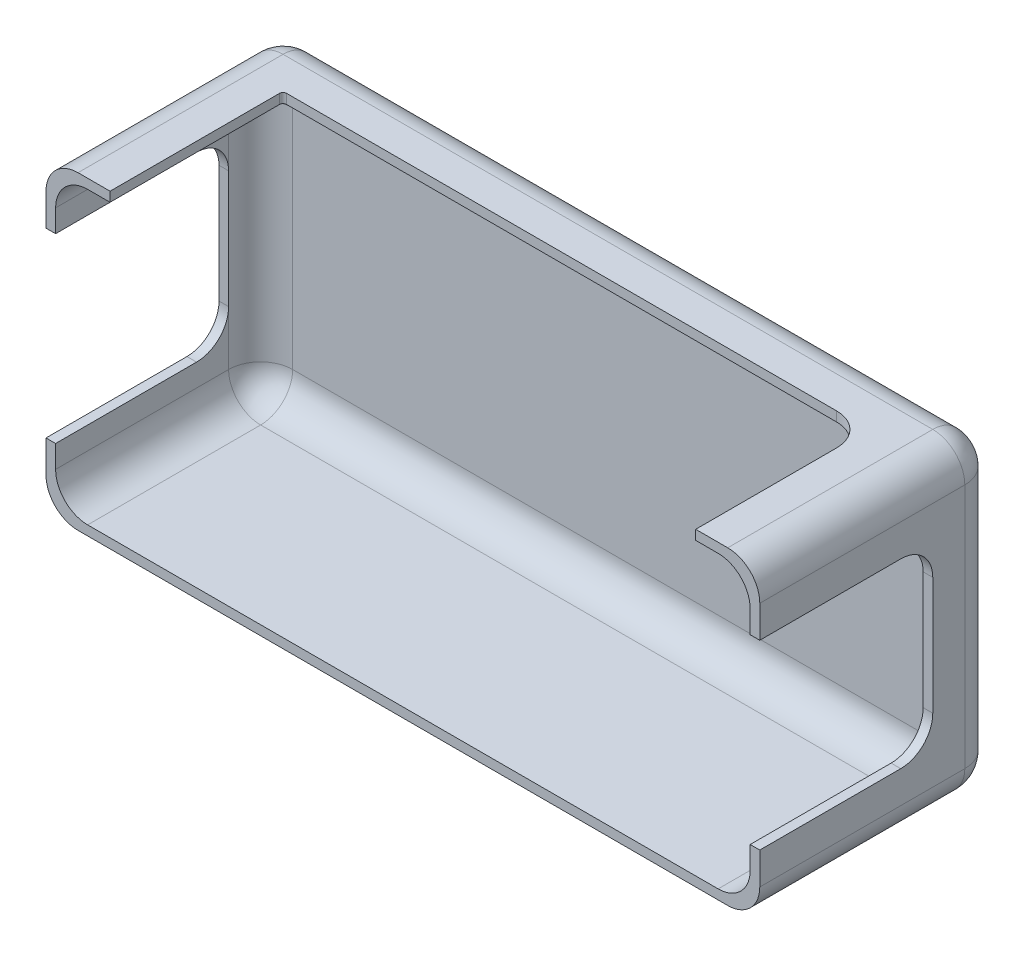
from build123d import *

# Parameters (mm, degrees)
RESSALTO_EXTRUS_O1_DEPTH = 5
ESBO_O4_W                = 1.5
ESBO_O4_H                = 45.351844832
RESSALTO_EXTRUS_O3_DEPTH = 32
FILETE2_R                = 5
CORTE_EXTRUS_O1_REACH    = 140.416
CORTE_EXTRUS_O3_REACH    = 144.196
CORTE_EXTRUS_O4_REACH    = 144.196
CORTE_EXTRUS_O5_DEPTH    = 2


with BuildPart() as part:
    # Esboço3 → Ressalto-extrusão1 (new body)
    with BuildSketch(Plane.XY):
        Polygon((-12.906877432, 80.25478313), (-122.306877432, 80.25478313), (-124.306877432, 80.25478313), (-124.306877432, 31.902938298), (-122.306877432, 31.902938298), (-12.906877432, 31.902938298), (-12.906877432, 33.902938298), (-12.906877432, 78.002938298), align=None)
    extrude(amount=RESSALTO_EXTRUS_O1_DEPTH)

    # Esboço4 → Ressalto-extrusão3 (add)
    with BuildSketch(Plane.XY.offset(5)):
        Polygon((-124.306877432, 80.25478313), (-124.306877432, 33.402938298), (-122.806877432, 33.402938298), (-122.806877432, 78.75478313), (-122.806877432, 80.25478313), align=None)
        Polygon((-14.406877432, 78.75478313), (-12.906877432, 78.75478313), (-12.906877432, 80.25478313), (-122.806877432, 80.25478313), (-122.806877432, 78.75478313), align=None)
        with Locations((-13.656877432, 56.078860714)):
            Rectangle(ESBO_O4_W, ESBO_O4_H)
        Polygon((-124.306877432, 31.902938298), (-12.906877432, 31.902938298), (-12.906877432, 33.402938298), (-14.406877432, 33.402938298), (-122.806877432, 33.402938298), (-124.306877432, 33.402938298), align=None)
    extrude(amount=RESSALTO_EXTRUS_O3_DEPTH)

    # Filete2
    filete2_edges = [part.edges().sort_by_distance(p)[0] for p in [
        (-124.306877432, 80.25478313, 18.5),
        (-12.906877432, 80.25478313, 18.5),
        (-122.806877432, 78.75478313, 21),
        (-14.406877432, 56.078860714, 5),
        (-14.406877432, 78.75478313, 21),
        (-68.606877432, 33.402938298, 5),
        (-14.406877432, 33.402938298, 21),
        (-122.806877432, 33.402938298, 21),
        (-68.606877432, 78.75478313, 5),
        (-122.806877432, 56.078860714, 5),
        (-68.606877432, 31.902938298, 0),
        (-124.306877432, 56.078860714, 0),
        (-68.606877432, 80.25478313, 0),
        (-12.906877432, 56.078860714, 0),
        (-12.906877432, 31.902938298, 18.5),
        (-124.306877432, 31.902938298, 18.5),
    ]]
    fillet(filete2_edges, radius=FILETE2_R)

    # Esboço5 → Corte-extrusão1 (cut, up to next)
    with BuildSketch(Plane(origin=(0, 80.25478313, 0), x_dir=(1, 0, 0), z_dir=(0, 1, 0)), mode=Mode.PRIVATE) as corte_extrus_o1_sk1:
        with BuildLine():
            Line((-114.306877432, -37), (-114.306877432, -10.559050732))
            ThreePointArc((-114.306877432, -10.559050732), (-114.143135263, -10.163742168), (-113.7478267, -10))
            Line((-113.7478267, -10), (-27.906877432, -10))
            ThreePointArc((-27.906877432, -10), (-24.371343526, -11.464466094), (-22.906877432, -15))
            Line((-22.906877432, -15), (-22.906877432, -37))
            Line((-22.906877432, -37), (-114.306877432, -37))
        make_face()
    corte_extrus_o1_tool1 = extrude(corte_extrus_o1_sk1.sketch, amount=-CORTE_EXTRUS_O1_REACH, mode=Mode.PRIVATE) & part.part
    add(corte_extrus_o1_tool1.solids().sort_by_distance((-68.702775, 80.254783, 23.527345))[0], mode=Mode.SUBTRACT)

    # Esboço8 → Corte-extrusão3 (cut, up to next)
    with BuildSketch(Plane(origin=(-12.906877432, 0, 0), x_dir=(0, 0, -1), z_dir=(1, 0, 0)), mode=Mode.PRIVATE) as corte_extrus_o3_sk1:
        with BuildLine():
            Line((-37, 70.25478313), (-15, 70.25478313))
            ThreePointArc((-15, 70.25478313), (-11.464466094, 68.790317036), (-10, 65.25478313))
            Line((-10, 65.25478313), (-10, 46.902938298))
            ThreePointArc((-10, 46.902938298), (-11.464466094, 43.367404392), (-15, 41.902938298))
            Line((-15, 41.902938298), (-37, 41.902938298))
            Line((-37, 41.902938298), (-37, 70.25478313))
        make_face()
    corte_extrus_o3_tool1 = extrude(corte_extrus_o3_sk1.sketch, amount=-CORTE_EXTRUS_O3_REACH, mode=Mode.PRIVATE) & part.part
    add(corte_extrus_o3_tool1.solids().sort_by_distance((-12.906877, 56.078861, 23.676044))[0], mode=Mode.SUBTRACT)

    # Esboço9 → Corte-extrusão4 (cut, up to next)
    with BuildSketch(Plane.ZY.offset(124.306877432), mode=Mode.PRIVATE) as corte_extrus_o4_sk1:
        with BuildLine():
            Line((37, 41.902938298), (15, 41.902938298))
            ThreePointArc((15, 41.902938298), (11.464466094, 43.367404392), (10, 46.902938298))
            Line((10, 46.902938298), (10, 65.25478313))
            ThreePointArc((10, 65.25478313), (11.464466094, 68.790317036), (15, 70.25478313))
            Line((15, 70.25478313), (37, 70.25478313))
            Line((37, 70.25478313), (37, 41.902938298))
        make_face()
    corte_extrus_o4_tool1 = extrude(corte_extrus_o4_sk1.sketch, amount=-CORTE_EXTRUS_O4_REACH, mode=Mode.PRIVATE) & part.part
    add(corte_extrus_o4_tool1.solids().sort_by_distance((-124.306877, 56.078861, 23.676044))[0], mode=Mode.SUBTRACT)

    # Esboço10 → Corte-extrusão5 (cut)
    # profile 1 of 9: a face of its own
    with BuildSketch(Plane(origin=(0, 0, 0), x_dir=(-1, 0, 0), z_dir=(0, 0, -1))):
        with BuildLine():
            Line((46.533087851, 54.952771825), (47.596545211, 54.167678145))
            add(Edge.make_bspline(
                [(49.285574091, 55.803224785), (49.013682331, 55.378638385), (48.023158531, 54.466453265), (47.596545211, 54.167678145)],
                knots=[0, 0, 0, 0, 0.01754386, 0.01754386, 0.01754386, 0.01754386], degree=3))
            add(Edge.make_bspline(
                [(51.224803131, 53.840490585), (50.623839131, 56.218067745), (51.300048091, 54.688454345), (49.285574091, 55.803224785)],
                knots=[0.964912281, 0.964912281, 0.964912281, 0.964912281, 1, 1, 1, 1], degree=3))
            add(Edge.make_bspline(
                [(51.537588891, 52.859212385), (51.460139211, 53.206953625), (51.318325931, 53.470524345), (51.224803131, 53.840490585)],
                knots=[0.947368421, 0.947368421, 0.947368421, 0.947368421, 0.964912281, 0.964912281, 0.964912281, 0.964912281], degree=3))
            Line((51.537588891, 52.859212385), (52.851281971, 52.859212385))
            add(Edge.make_bspline(
                [(53.138997931, 53.866769425), (53.068304651, 53.528558265), (52.969092251, 53.115920025), (52.851281971, 52.859212385)],
                knots=[0.912280702, 0.912280702, 0.912280702, 0.912280702, 0.929824561, 0.929824561, 0.929824561, 0.929824561], degree=3))
            add(Edge.make_bspline(
                [(54.978232251, 55.803224785), (52.907360091, 54.657268225), (53.626632211, 56.199256505), (53.138997931, 53.866769425)],
                knots=[0.894736842, 0.894736842, 0.894736842, 0.894736842, 0.912280702, 0.912280702, 0.912280702, 0.912280702], degree=3))
            add(Edge.make_bspline(
                [(56.792361211, 54.298503385), (56.600266091, 54.298503385), (55.217515491, 55.429560305), (54.978232251, 55.803224785)],
                knots=[0.877192982, 0.877192982, 0.877192982, 0.877192982, 0.894736842, 0.894736842, 0.894736842, 0.894736842], degree=3))
            add(Edge.make_bspline(
                [(57.855818571, 55.148991905), (57.747111651, 54.979228465), (56.987443371, 54.298503385), (56.792361211, 54.298503385)],
                knots=[0.859649123, 0.859649123, 0.859649123, 0.859649123, 0.877192982, 0.877192982, 0.877192982, 0.877192982], degree=3))
            add(Edge.make_bspline(
                [(56.917496851, 57.307981745), (57.482082971, 56.192108945), (57.463449531, 56.004245465), (57.855818571, 55.148991905)],
                knots=[0.842105263, 0.842105263, 0.842105263, 0.842105263, 0.859649123, 0.859649123, 0.859649123, 0.859649123], degree=3))
            add(Edge.make_bspline(
                [(57.918368611, 58.681913465), (57.706110971, 58.350352025), (57.247458091, 57.539086185), (56.917496851, 57.307981745)],
                knots=[0.824561404, 0.824561404, 0.824561404, 0.824561404, 0.842105263, 0.842105263, 0.842105263, 0.842105263], degree=3))
            add(Edge.make_bspline(
                [(58.361055051, 58.621497025), (58.169920051, 58.643935385), (58.197799091, 58.681913465), (57.918368611, 58.681913465)],
                knots=[0.807017544, 0.807017544, 0.807017544, 0.807017544, 0.824561404, 0.824561404, 0.824561404, 0.824561404], degree=3))
            add(Edge.make_bspline(
                [(58.789410811, 58.611504665), (58.649873371, 58.627933385), (58.500592491, 58.605103865), (58.361055051, 58.621497025)],
                knots=[0.789473684, 0.789473684, 0.789473684, 0.789473684, 0.807017544, 0.807017544, 0.807017544, 0.807017544], degree=3))
            Line((58.789410811, 58.611504665), (60.233004571, 58.551088225))
            add(Edge.make_bspline(
                [(60.670890411, 59.924948825), (60.577189811, 59.720798865), (60.496148571, 59.124635465), (60.233004571, 58.551088225)],
                knots=[0.754385965, 0.754385965, 0.754385965, 0.754385965, 0.771929825, 0.771929825, 0.771929825, 0.771929825], degree=3))
            add(Edge.make_bspline(
                [(58.669075771, 61.102589345), (59.112188931, 60.994593625), (60.264581851, 60.209499945), (60.670890411, 59.924948825)],
                knots=[0.736842105, 0.736842105, 0.736842105, 0.736842105, 0.754385965, 0.754385965, 0.754385965, 0.754385965], degree=3))
            add(Edge.make_bspline(
                [(58.669075771, 62.869067905), (58.760393851, 61.721404465), (58.760393851, 62.250217225), (58.669075771, 61.102589345)],
                knots=[0.719298246, 0.719298246, 0.719298246, 0.719298246, 0.736842105, 0.736842105, 0.736842105, 0.736842105], degree=3))
            Line((58.669075771, 62.869067905), (59.696368611, 63.495670665))
            add(Edge.make_bspline(
                [(60.428762371, 64.905660225), (60.655386251, 64.188379465), (60.860745251, 64.323543025), (59.696368611, 63.495670665)],
                knots=[0.684210526, 0.684210526, 0.684210526, 0.684210526, 0.701754386, 0.701754386, 0.701754386, 0.701754386], degree=3))
            add(Edge.make_bspline(
                [(60.233004571, 65.551429825), (60.250642331, 65.329464305), (60.358958091, 65.126594505), (60.428762371, 64.905660225)],
                knots=[0.666666667, 0.666666667, 0.666666667, 0.666666667, 0.684210526, 0.684210526, 0.684210526, 0.684210526], degree=3))
            add(Edge.make_bspline(
                [(57.918368611, 65.289743785), (58.700617491, 65.480309825), (59.345818131, 65.551429825), (60.233004571, 65.551429825)],
                knots=[0.649122807, 0.649122807, 0.649122807, 0.649122807, 0.666666667, 0.666666667, 0.666666667, 0.666666667], degree=3))
            add(Edge.make_bspline(
                [(57.463520651, 66.057093025), (57.631612771, 65.827233185), (57.792059491, 65.539446105), (57.918368611, 65.289743785)],
                knots=[0.631578947, 0.631578947, 0.631578947, 0.631578947, 0.649122807, 0.649122807, 0.649122807, 0.649122807], degree=3))
            Line((57.463520651, 66.057093025), (56.917496851, 66.729070345))
            add(Edge.make_bspline(
                [(57.730718491, 69.084280265), (57.717810211, 68.478729025), (57.143053931, 67.174850505), (56.917496851, 66.729070345)],
                knots=[0.596491228, 0.596491228, 0.596491228, 0.596491228, 0.614035088, 0.614035088, 0.614035088, 0.614035088], degree=3))
            add(Edge.make_bspline(
                [(56.667261131, 69.803979105), (57.156744531, 69.533118585), (57.514407011, 69.144732265), (57.730718491, 69.084280265)],
                knots=[0.578947368, 0.578947368, 0.578947368, 0.578947368, 0.596491228, 0.596491228, 0.596491228, 0.596491228], degree=3))
            Line((56.667261131, 69.803979105), (56.204056571, 69.437853345))
            add(Edge.make_bspline(
                [(55.766348531, 69.045164265), (55.949198051, 69.187297585), (56.001542371, 69.278686785), (56.204056571, 69.437853345)],
                knots=[0.543859649, 0.543859649, 0.543859649, 0.543859649, 0.561403509, 0.561403509, 0.561403509, 0.561403509], degree=3))
            add(Edge.make_bspline(
                [(54.915646651, 68.233756185), (55.214919611, 68.443382385), (55.428919691, 68.782767025), (55.766348531, 69.045164265)],
                knots=[0.526315789, 0.526315789, 0.526315789, 0.526315789, 0.543859649, 0.543859649, 0.543859649, 0.543859649], degree=3))
            add(Edge.make_bspline(
                [(53.351753411, 68.757199385), (53.784340811, 68.719541345), (54.599589371, 68.408711385), (54.915646651, 68.233756185)],
                knots=[0.50877193, 0.50877193, 0.50877193, 0.50877193, 0.526315789, 0.526315789, 0.526315789, 0.526315789], degree=3))
            add(Edge.make_bspline(
                [(52.726181891, 71.112444865), (52.922864251, 70.683769065), (53.306272171, 69.328613025), (53.351753411, 68.757199385)],
                knots=[0.49122807, 0.49122807, 0.49122807, 0.49122807, 0.50877193, 0.50877193, 0.50877193, 0.50877193], degree=3))
            Line((52.726181891, 71.112444865), (51.412488811, 71.112444865))
            add(Edge.make_bspline(
                [(50.912052931, 68.757199385), (50.922543131, 69.250309905), (51.257056051, 70.773700305), (51.412488811, 71.112444865)],
                knots=[0.456140351, 0.456140351, 0.456140351, 0.456140351, 0.473684211, 0.473684211, 0.473684211, 0.473684211], degree=3))
            add(Edge.make_bspline(
                [(49.348124131, 68.233756185), (49.643876651, 68.397438865), (50.507949091, 68.722030545), (50.912052931, 68.757199385)],
                knots=[0.438596491, 0.438596491, 0.438596491, 0.438596491, 0.456140351, 0.456140351, 0.456140351, 0.456140351], degree=3))
            add(Edge.make_bspline(
                [(47.959612811, 69.398630665), (48.563066011, 68.979627185), (48.905579931, 68.543732705), (49.348124131, 68.233756185)],
                knots=[0.421052632, 0.421052632, 0.421052632, 0.421052632, 0.438596491, 0.438596491, 0.438596491, 0.438596491], degree=3))
            add(Edge.make_bspline(
                [(47.471445131, 69.738548705), (47.682813771, 69.621591865), (47.758094291, 69.538559265), (47.959612811, 69.398630665)],
                knots=[0.403508772, 0.403508772, 0.403508772, 0.403508772, 0.421052632, 0.421052632, 0.421052632, 0.421052632], degree=3))
            Line((47.471445131, 69.738548705), (46.674225491, 69.132961905))
            add(Edge.make_bspline(
                [(46.407952211, 68.953455025), (46.622201211, 69.013302505), (46.526295891, 68.984427785), (46.674225491, 69.132961905)],
                knots=[0.368421053, 0.368421053, 0.368421053, 0.368421053, 0.385964912, 0.385964912, 0.385964912, 0.385964912], degree=3))
            add(Edge.make_bspline(
                [(46.837268091, 67.766817825), (46.695845971, 68.144393905), (46.507555771, 68.506323585), (46.407952211, 68.953455025)],
                knots=[0.350877193, 0.350877193, 0.350877193, 0.350877193, 0.368421053, 0.368421053, 0.368421053, 0.368421053], degree=3))
            add(Edge.make_bspline(
                [(47.346309491, 66.729070345), (47.146142251, 67.041678305), (46.980325971, 67.384867865), (46.837268091, 67.766817825)],
                knots=[0.333333333, 0.333333333, 0.333333333, 0.333333333, 0.350877193, 0.350877193, 0.350877193, 0.350877193], degree=3))
            add(Edge.make_bspline(
                [(46.345402171, 65.289743785), (46.800356811, 66.188949505), (47.158197091, 66.435238065), (47.346309491, 66.729070345)],
                knots=[0.315789474, 0.315789474, 0.315789474, 0.315789474, 0.333333333, 0.333333333, 0.333333333, 0.333333333], degree=3))
            add(Edge.make_bspline(
                [(44.030801771, 65.420533465), (44.765435811, 65.420533465), (45.670971211, 65.454030985), (46.345402171, 65.289743785)],
                knots=[0.298245614, 0.298245614, 0.298245614, 0.298245614, 0.315789474, 0.315789474, 0.315789474, 0.315789474], degree=3))
            add(Edge.make_bspline(
                [(44.568255611, 63.431093705), (43.724523491, 63.970254425), (43.309218251, 63.847785785), (44.030801771, 65.420533465)],
                knots=[0.280701754, 0.280701754, 0.280701754, 0.280701754, 0.298245614, 0.298245614, 0.298245614, 0.298245614], degree=3))
            add(Edge.make_bspline(
                [(45.594730571, 62.869067905), (45.243540011, 63.063403305), (44.920335171, 63.206141145), (44.568255611, 63.431093705)],
                knots=[0.263157895, 0.263157895, 0.263157895, 0.263157895, 0.280701754, 0.280701754, 0.280701754, 0.280701754], degree=3))
            add(Edge.make_bspline(
                [(45.532180531, 62.149369065), (45.532180531, 62.512614465), (45.594730571, 62.537328665), (45.594730571, 62.869067905)],
                knots=[0.245614035, 0.245614035, 0.245614035, 0.245614035, 0.263157895, 0.263157895, 0.263157895, 0.263157895], degree=3))
            Line((45.532180531, 62.149369065), (45.594730571, 61.102589345))
            add(Edge.make_bspline(
                [(45.056352171, 60.815157865), (45.241015251, 60.933145945), (45.417570651, 61.004585985), (45.594730571, 61.102589345)],
                knots=[0.210526316, 0.210526316, 0.210526316, 0.210526316, 0.228070175, 0.228070175, 0.228070175, 0.228070175], degree=3))
            add(Edge.make_bspline(
                [(44.794808371, 60.629783585), (44.880934691, 60.685719465), (44.967381051, 60.758297425), (45.056352171, 60.815157865)],
                knots=[0.192982456, 0.192982456, 0.192982456, 0.192982456, 0.210526316, 0.210526316, 0.210526316, 0.210526316], degree=3))
            Line((44.794808371, 60.629783585), (44.082648251, 60.132405865))
            add(Edge.make_bspline(
                [(43.655465971, 59.728657625), (43.768831251, 59.905746425), (43.913524891, 60.000051545), (44.082648251, 60.132405865)],
                knots=[0.157894737, 0.157894737, 0.157894737, 0.157894737, 0.175438596, 0.175438596, 0.175438596, 0.175438596], degree=3))
            add(Edge.make_bspline(
                [(44.093387371, 58.420191865), (43.954774491, 58.694181665), (43.731030971, 59.389557465), (43.655465971, 59.728657625)],
                knots=[0.140350877, 0.140350877, 0.140350877, 0.140350877, 0.157894737, 0.157894737, 0.157894737, 0.157894737], degree=3))
            add(Edge.make_bspline(
                [(45.307796931, 58.524062625), (45.016916131, 58.471256025), (44.383379171, 58.420191865), (44.093387371, 58.420191865)],
                knots=[0.122807018, 0.122807018, 0.122807018, 0.122807018, 0.140350877, 0.140350877, 0.140350877, 0.140350877], degree=3))
            Line((45.307796931, 58.524062625), (46.407952211, 58.681913465))
            add(Edge.make_bspline(
                [(47.070719491, 57.608605985), (46.887514371, 57.866095945), (46.485330771, 58.334634505), (46.407952211, 58.681913465)],
                knots=[0.087719298, 0.087719298, 0.087719298, 0.087719298, 0.105263158, 0.105263158, 0.105263158, 0.105263158], degree=3))
            add(Edge.make_bspline(
                [(47.346309491, 57.307981745), (47.166553691, 57.433864145), (47.202824891, 57.422911665), (47.070719491, 57.608605985)],
                knots=[0.070175439, 0.070175439, 0.070175439, 0.070175439, 0.087719298, 0.087719298, 0.087719298, 0.087719298], degree=3))
            Line((47.346309491, 57.307981745), (46.883282731, 56.156655625))
            add(Edge.make_bspline(
                [(46.533087851, 54.952771825), (46.558299891, 55.269682545), (46.768637291, 55.849274985), (46.883282731, 56.156655625)],
                knots=[0.035087719, 0.035087719, 0.035087719, 0.035087719, 0.052631579, 0.052631579, 0.052631579, 0.052631579], degree=3))
        make_face()
        with BuildLine():
            add(Edge.make_bspline(
                [(48.096981091, 62.083974225), (48.096981091, 60.754848105), (48.720276771, 59.331808025), (49.773279491, 58.603148065)],
                knots=[0, 0, 0, 0, 0.111111111, 0.111111111, 0.111111111, 0.111111111], degree=3))
            add(Edge.make_bspline(
                [(49.080570691, 64.719005785), (48.521923091, 64.014171025), (48.096981091, 62.991643225), (48.096981091, 62.083974225)],
                knots=[0.777777778, 0.777777778, 0.777777778, 0.777777778, 1, 1, 1, 1], degree=3))
            add(Edge.make_bspline(
                [(49.583140171, 65.240208705), (49.122567051, 64.823481065), (49.504517011, 65.253828185), (49.080570691, 64.719005785)],
                knots=[0.666666667, 0.666666667, 0.666666667, 0.666666667, 0.777777778, 0.777777778, 0.777777778, 0.777777778], degree=3))
            add(Edge.make_bspline(
                [(55.817768291, 63.681613905), (54.896088651, 66.131128945), (51.588190771, 67.054479905), (49.583140171, 65.240208705)],
                knots=[0.555555556, 0.555555556, 0.555555556, 0.555555556, 0.666666667, 0.666666667, 0.666666667, 0.666666667], degree=3))
            add(Edge.make_bspline(
                [(55.770544611, 60.208504265), (56.323040331, 61.354887545), (56.250640171, 62.531105665), (55.817768291, 63.681613905)],
                knots=[0.444444444, 0.444444444, 0.444444444, 0.444444444, 0.555555556, 0.555555556, 0.555555556, 0.555555556], degree=3))
            add(Edge.make_bspline(
                [(55.404134371, 59.544954665), (55.563656531, 59.796506105), (55.631896171, 59.920930545), (55.770544611, 60.208504265)],
                knots=[0.333333333, 0.333333333, 0.333333333, 0.333333333, 0.444444444, 0.444444444, 0.444444444, 0.444444444], degree=3))
            add(Edge.make_bspline(
                [(52.038060331, 57.831389385), (53.394105371, 57.833949705), (54.668611331, 58.384738545), (55.404134371, 59.544954665)],
                knots=[0.222222222, 0.222222222, 0.222222222, 0.222222222, 0.333333333, 0.333333333, 0.333333333, 0.333333333], degree=3))
            add(Edge.make_bspline(
                [(49.773279491, 58.603148065), (50.490524691, 58.106872705), (51.041349091, 57.829469145), (52.038060331, 57.831389385)],
                knots=[0.111111111, 0.111111111, 0.111111111, 0.111111111, 0.222222222, 0.222222222, 0.222222222, 0.222222222], degree=3))
        make_face(mode=Mode.SUBTRACT)
    # profile 2 of 9: a face of its own
    with BuildSketch(Plane(origin=(0, 0, 0), x_dir=(-1, 0, 0), z_dir=(0, 0, -1))):
        with BuildLine():
            Line((76.022614883, 54.875962225), (76.431331331, 54.838339745))
            add(Edge.make_bspline(
                [(76.431331331, 54.838339745), (76.958223851, 54.763059225), (77.522738851, 54.612533745), (78.425962851, 53.690498505)],
                knots=[0.621621622, 0.621621622, 0.621621622, 0.621621622, 0.648648649, 0.648648649, 0.648648649, 0.648648649], degree=3))
            add(Edge.make_bspline(
                [(78.425962851, 53.690498505), (79.385620571, 52.693182745), (80.514650571, 51.300724265), (81.888297811, 49.607179265)],
                knots=[0.648648649, 0.648648649, 0.648648649, 0.648648649, 0.675675676, 0.675675676, 0.675675676, 0.675675676], degree=3))
            add(Edge.make_bspline(
                [(81.888297811, 49.607179265), (80.401747571, 48.402868745), (79.893701851, 47.085655225), (79.893701851, 46.050716985)],
                knots=[0.675675676, 0.675675676, 0.675675676, 0.675675676, 0.702702703, 0.702702703, 0.702702703, 0.702702703], degree=3))
            add(Edge.make_bspline(
                [(79.893701851, 46.050716985), (79.893701851, 44.771161505), (80.665176051, 44.018462985), (81.022731851, 43.755034505)],
                knots=[0.702702703, 0.702702703, 0.702702703, 0.702702703, 0.72972973, 0.72972973, 0.72972973, 0.72972973], degree=3))
            add(Edge.make_bspline(
                [(81.022731851, 43.755034505), (81.907109051, 43.134085785), (83.054985851, 43.039994025), (84.108735331, 43.039994025)],
                knots=[0.72972973, 0.72972973, 0.72972973, 0.72972973, 0.756756757, 0.756756757, 0.756756757, 0.756756757], degree=3))
            add(Edge.make_bspline(
                [(84.108735331, 43.039994025), (84.635627851, 43.039994025), (85.915183331, 43.096427745), (86.084520051, 43.096427745)],
                knots=[0.756756757, 0.756756757, 0.756756757, 0.756756757, 0.783783784, 0.783783784, 0.783783784, 0.783783784], degree=3))
            add(Edge.make_bspline(
                [(86.084520051, 43.096427745), (86.122178091, 43.096427745), (87.270019331, 43.039994025), (88.079151571, 43.039994025)],
                knots=[0.783783784, 0.783783784, 0.783783784, 0.783783784, 0.810810811, 0.810810811, 0.810810811, 0.810810811], degree=3))
            add(Edge.make_bspline(
                [(88.079151571, 43.039994025), (88.248488291, 43.039994025), (88.304957571, 43.096427745), (88.304957571, 43.171708265)],
                knots=[0.810810811, 0.810810811, 0.810810811, 0.810810811, 0.837837838, 0.837837838, 0.837837838, 0.837837838], degree=3))
            add(Edge.make_bspline(
                [(88.304957571, 43.171708265), (88.304957571, 43.246988785), (88.229677051, 43.284611265), (88.097962811, 43.284611265)],
                knots=[0.837837838, 0.837837838, 0.837837838, 0.837837838, 0.864864865, 0.864864865, 0.864864865, 0.864864865], degree=3))
            add(Edge.make_bspline(
                [(88.097962811, 43.284611265), (87.947437331, 43.284611265), (87.759253811, 43.303422505), (87.646350811, 43.322233745)],
                knots=[0.864864865, 0.864864865, 0.864864865, 0.864864865, 0.891891892, 0.891891892, 0.891891892, 0.891891892], degree=3))
            add(Edge.make_bspline(
                [(87.646350811, 43.322233745), (87.063024571, 43.435136745), (86.931310331, 43.717412025), (86.893652291, 44.225457745)],
                knots=[0.891891892, 0.891891892, 0.891891892, 0.891891892, 0.918918919, 0.918918919, 0.918918919, 0.918918919], degree=3))
            add(Edge.make_bspline(
                [(86.893652291, 44.225457745), (86.856029811, 44.733539025), (86.856029811, 45.185151025), (86.856029811, 47.669017025)],
                knots=[0.918918919, 0.918918919, 0.918918919, 0.918918919, 0.945945946, 0.945945946, 0.945945946, 0.945945946], degree=3))
            Line((86.856029811, 47.669017025), (86.856029811, 50.491556465))
            add(Edge.make_bspline(
                [(86.856029811, 50.491556465), (86.856029811, 51.902861745), (86.837218571, 53.445881265), (86.931310331, 54.123299265)],
                knots=[0, 0, 0, 0, 0.027027027, 0.027027027, 0.027027027, 0.027027027], degree=3))
            add(Edge.make_bspline(
                [(86.931310331, 54.123299265), (86.987744051, 54.574911265), (87.100647051, 54.781870465), (87.420544811, 54.838339745)],
                knots=[0.027027027, 0.027027027, 0.027027027, 0.027027027, 0.054054054, 0.054054054, 0.054054054, 0.054054054], degree=3))
            add(Edge.make_bspline(
                [(87.420544811, 54.838339745), (87.571070291, 54.875962225), (87.702820091, 54.875962225), (87.834534331, 54.875962225)],
                knots=[0.054054054, 0.054054054, 0.054054054, 0.054054054, 0.081081081, 0.081081081, 0.081081081, 0.081081081], degree=3))
            add(Edge.make_bspline(
                [(87.834534331, 54.875962225), (87.947437331, 54.875962225), (88.060340331, 54.932431505), (88.060340331, 54.988865225)],
                knots=[0.081081081, 0.081081081, 0.081081081, 0.081081081, 0.108108108, 0.108108108, 0.108108108, 0.108108108], degree=3))
            add(Edge.make_bspline(
                [(88.060340331, 54.988865225), (88.060340331, 55.101768225), (87.985059811, 55.139390705), (87.796876291, 55.139390705)],
                knots=[0.108108108, 0.108108108, 0.108108108, 0.108108108, 0.135135135, 0.135135135, 0.135135135, 0.135135135], degree=3))
            add(Edge.make_bspline(
                [(87.796876291, 55.139390705), (87.288830571, 55.139390705), (86.460887091, 55.082956985), (86.159800571, 55.082956985)],
                knots=[0.135135135, 0.135135135, 0.135135135, 0.135135135, 0.162162162, 0.162162162, 0.162162162, 0.162162162], degree=3))
            add(Edge.make_bspline(
                [(86.159800571, 55.082956985), (86.084520051, 55.082956985), (85.030770571, 55.139390705), (84.052266051, 55.139390705)],
                knots=[0.162162162, 0.162162162, 0.162162162, 0.162162162, 0.189189189, 0.189189189, 0.189189189, 0.189189189], degree=3))
            add(Edge.make_bspline(
                [(84.052266051, 55.139390705), (83.864118091, 55.139390705), (83.788837571, 55.082956985), (83.788837571, 54.988865225)],
                knots=[0.189189189, 0.189189189, 0.189189189, 0.189189189, 0.216216216, 0.216216216, 0.216216216, 0.216216216], degree=3))
            add(Edge.make_bspline(
                [(83.788837571, 54.988865225), (83.788837571, 54.932431505), (83.864118091, 54.875962225), (84.033454811, 54.875962225)],
                knots=[0.216216216, 0.216216216, 0.216216216, 0.216216216, 0.243243243, 0.243243243, 0.243243243, 0.243243243], degree=3))
            add(Edge.make_bspline(
                [(84.033454811, 54.875962225), (84.184015851, 54.875962225), (84.390975051, 54.857150985), (84.579158571, 54.838339745)],
                knots=[0.243243243, 0.243243243, 0.243243243, 0.243243243, 0.27027027, 0.27027027, 0.27027027, 0.27027027], degree=3))
            add(Edge.make_bspline(
                [(84.579158571, 54.838339745), (85.200107291, 54.763059225), (85.256576571, 54.386727745), (85.313010291, 53.935115745)],
                knots=[0.27027027, 0.27027027, 0.27027027, 0.27027027, 0.297297297, 0.297297297, 0.297297297, 0.297297297], degree=3))
            add(Edge.make_bspline(
                [(85.313010291, 53.935115745), (85.407102051, 53.257697745), (85.407102051, 51.884050505), (85.407102051, 50.378689025)],
                knots=[0.297297297, 0.297297297, 0.297297297, 0.297297297, 0.324324324, 0.324324324, 0.324324324, 0.324324324], degree=3))
            Line((85.407102051, 50.378689025), (85.407102051, 50.115224985))
            add(Edge.make_bspline(
                [(85.407102051, 50.115224985), (85.407102051, 50.039980025), (85.388290811, 50.021133225), (85.313010291, 50.021133225)],
                knots=[0.351351351, 0.351351351, 0.351351351, 0.351351351, 0.378378378, 0.378378378, 0.378378378, 0.378378378], degree=3))
            Line((85.313010291, 50.021133225), (83.374848051, 50.039980025))
            add(Edge.make_bspline(
                [(83.374848051, 50.039980025), (83.261945051, 50.039980025), (83.224322571, 50.077602505), (83.149042051, 50.152883025)],
                knots=[0.405405405, 0.405405405, 0.405405405, 0.405405405, 0.432432432, 0.432432432, 0.432432432, 0.432432432], degree=3))
            add(Edge.make_bspline(
                [(83.149042051, 50.152883025), (82.829179851, 50.548025745), (82.076481331, 51.564152745), (81.342594051, 52.467376745)],
                knots=[0.432432432, 0.432432432, 0.432432432, 0.432432432, 0.459459459, 0.459459459, 0.459459459, 0.459459459], degree=3))
            add(Edge.make_bspline(
                [(81.342594051, 52.467376745), (80.364125091, 53.728120985), (79.799610091, 54.574911265), (79.009289091, 54.913620265)],
                knots=[0.459459459, 0.459459459, 0.459459459, 0.459459459, 0.486486486, 0.486486486, 0.486486486, 0.486486486], degree=3))
            add(Edge.make_bspline(
                [(79.009289091, 54.913620265), (78.595299571, 55.082956985), (78.181345611, 55.139390705), (77.296932851, 55.139390705)],
                knots=[0.486486486, 0.486486486, 0.486486486, 0.486486486, 0.513513514, 0.513513514, 0.513513514, 0.513513514], degree=3))
            Line((77.296932851, 55.139390705), (75.979719331, 55.139390705))
            ThreePointArc((75.979719331, 55.139390705), (75.884514949, 54.988681333), (76.022614883, 54.875962225))
        make_face()
        with BuildLine():
            add(Edge.make_bspline(
                [(85.313010291, 49.230812225), (85.388290811, 49.193189745), (85.407102051, 49.099097985), (85.407102051, 49.005006225)],
                knots=[0.666666667, 0.666666667, 0.666666667, 0.666666667, 0.777777778, 0.777777778, 0.777777778, 0.777777778], degree=3))
            Line((85.407102051, 49.005006225), (85.407102051, 43.886748745))
            add(Edge.make_bspline(
                [(85.407102051, 43.886748745), (85.407102051, 43.792656985), (85.350668331, 43.736223265), (85.294199051, 43.717412025)],
                knots=[0, 0, 0, 0, 0.111111111, 0.111111111, 0.111111111, 0.111111111], degree=3))
            add(Edge.make_bspline(
                [(85.294199051, 43.717412025), (85.068393051, 43.660942745), (84.673250331, 43.623320265), (84.202827091, 43.623320265)],
                knots=[0.111111111, 0.111111111, 0.111111111, 0.111111111, 0.222222222, 0.222222222, 0.222222222, 0.222222222], degree=3))
            add(Edge.make_bspline(
                [(84.202827091, 43.623320265), (82.528093331, 43.623320265), (81.436685811, 44.752350265), (81.436685811, 46.803415505)],
                knots=[0.222222222, 0.222222222, 0.222222222, 0.222222222, 0.333333333, 0.333333333, 0.333333333, 0.333333333], degree=3))
            add(Edge.make_bspline(
                [(81.436685811, 46.803415505), (81.436685811, 48.007726025), (81.813052851, 48.835669505), (82.377567851, 49.193189745)],
                knots=[0.333333333, 0.333333333, 0.333333333, 0.333333333, 0.444444444, 0.444444444, 0.444444444, 0.444444444], degree=3))
            add(Edge.make_bspline(
                [(82.377567851, 49.193189745), (82.772710571, 49.456618225), (83.243133811, 49.475465025), (83.638312091, 49.475465025)],
                knots=[0.444444444, 0.444444444, 0.444444444, 0.444444444, 0.555555556, 0.555555556, 0.555555556, 0.555555556], degree=3))
            add(Edge.make_bspline(
                [(83.638312091, 49.475465025), (84.315730091, 49.475465025), (85.068393051, 49.362562025), (85.313010291, 49.230812225)],
                knots=[0.555555556, 0.555555556, 0.555555556, 0.555555556, 0.666666667, 0.666666667, 0.666666667, 0.666666667], degree=3))
        make_face(mode=Mode.SUBTRACT)
    # profile 3 of 9: a face of its own
    with BuildSketch(Plane(origin=(0, 0, 0), x_dir=(-1, 0, 0), z_dir=(0, 0, -1))):
        with BuildLine():
            Line((65.299913411, 54.756658425), (64.212488611, 54.127424225))
            Line((64.212488611, 54.127424225), (64.111498211, 54.036781785))
            add(Edge.make_bspline(
                [(64.111498211, 54.036781785), (63.853688211, 54.217355465), (63.640008171, 54.372290385), (63.318367971, 54.515774985)],
                knots=[0.378378378, 0.378378378, 0.378378378, 0.378378378, 0.405405405, 0.405405405, 0.405405405, 0.405405405], degree=3))
            add(Edge.make_bspline(
                [(63.318367971, 54.515774985), (63.044662651, 54.637923585), (62.682946331, 54.793783065), (62.359919291, 54.821911025)],
                knots=[0.405405405, 0.405405405, 0.405405405, 0.405405405, 0.432432432, 0.432432432, 0.432432432, 0.432432432], degree=3))
            add(Edge.make_bspline(
                [(62.359919291, 54.821911025), (62.281402811, 55.808523225), (61.604482651, 56.950745985), (61.546662091, 57.177192065)],
                knots=[0.432432432, 0.432432432, 0.432432432, 0.432432432, 0.459459459, 0.459459459, 0.459459459, 0.459459459], degree=3))
            add(Edge.make_bspline(
                [(61.546662091, 57.177192065), (60.714202491, 57.177192065), (60.371404091, 57.025635345), (59.857633211, 56.980900865)],
                knots=[0.459459459, 0.459459459, 0.459459459, 0.459459459, 0.486486486, 0.486486486, 0.486486486, 0.486486486], degree=3))
            add(Edge.make_bspline(
                [(59.857633211, 56.980900865), (59.814285571, 56.435694945), (59.475327651, 55.055397985), (59.732533131, 54.494759025)],
                knots=[0.486486486, 0.486486486, 0.486486486, 0.486486486, 0.513513514, 0.513513514, 0.513513514, 0.513513514], degree=3))
            add(Edge.make_bspline(
                [(59.732533131, 54.494759025), (59.354174731, 54.461866025), (58.783294491, 53.983263985), (58.495578531, 53.694836825)],
                knots=[0.513513514, 0.513513514, 0.513513514, 0.513513514, 0.540540541, 0.540540541, 0.540540541, 0.540540541], degree=3))
            add(Edge.make_bspline(
                [(58.495578531, 53.694836825), (58.359099251, 53.558108625), (58.323148091, 53.490757985), (58.168604331, 53.382548905)],
                knots=[0.540540541, 0.540540541, 0.540540541, 0.540540541, 0.567567568, 0.567567568, 0.567567568, 0.567567568], degree=3))
            add(Edge.make_bspline(
                [(58.168604331, 53.382548905), (57.798993691, 53.472657945), (57.502138811, 53.585987665), (57.070084811, 53.673038545)],
                knots=[0.567567568, 0.567567568, 0.567567568, 0.567567568, 0.594594595, 0.594594595, 0.594594595, 0.594594595], degree=3))
            add(Edge.make_bspline(
                [(57.070084811, 53.673038545), (56.646494091, 53.758382545), (56.267495611, 53.775131305), (55.791453891, 53.775131305)],
                knots=[0.594594595, 0.594594595, 0.594594595, 0.594594595, 0.621621622, 0.621621622, 0.621621622, 0.621621622], degree=3))
            add(Edge.make_bspline(
                [(55.791453891, 53.775131305), (55.723178691, 53.468497425), (55.557789131, 53.263849625), (55.441152331, 52.963865465)],
                knots=[0.621621622, 0.621621622, 0.621621622, 0.621621622, 0.648648649, 0.648648649, 0.648648649, 0.648648649], degree=3))
            Line((55.441152331, 52.963865465), (55.165917931, 52.139513545))
            Line((55.165917931, 52.139513545), (55.619983571, 51.763893265))
            add(Edge.make_bspline(
                [(55.619983571, 51.763893265), (55.851301371, 51.556116185), (56.834926531, 50.896904905), (57.105146971, 50.831047785)],
                knots=[0.702702703, 0.702702703, 0.702702703, 0.702702703, 0.72972973, 0.72972973, 0.72972973, 0.72972973], degree=3))
            add(Edge.make_bspline(
                [(57.105146971, 50.831047785), (57.105146971, 50.208392185), (57.069266931, 49.915306665), (57.203612611, 49.298411785)],
                knots=[0.72972973, 0.72972973, 0.72972973, 0.72972973, 0.756756757, 0.756756757, 0.756756757, 0.756756757], degree=3))
            add(Edge.make_bspline(
                [(57.203612611, 49.298411785), (57.396170011, 48.414034585), (57.197745211, 48.978158425), (56.479042051, 47.952963625)],
                knots=[0.756756757, 0.756756757, 0.756756757, 0.756756757, 0.783783784, 0.783783784, 0.783783784, 0.783783784], degree=3))
            Line((56.479042051, 47.952963625), (55.791453891, 46.905614945))
            ThreePointArc((55.791453891, 46.905614945), (56.24959084, 46.161671585), (56.854946811, 45.531683225))
            add(Edge.make_bspline(
                [(56.854946811, 45.531683225), (57.209800051, 45.709803265), (57.587980651, 45.815629825), (57.960009371, 46.011529865)],
                knots=[0.864864865, 0.864864865, 0.864864865, 0.864864865, 0.891891892, 0.891891892, 0.891891892, 0.891891892], degree=3))
            add(Edge.make_bspline(
                [(57.960009371, 46.011529865), (58.336554211, 46.209847985), (58.568192051, 46.384234225), (58.919311491, 46.578498505)],
                knots=[0.891891892, 0.891891892, 0.891891892, 0.891891892, 0.918918919, 0.918918919, 0.918918919, 0.918918919], degree=3))
            add(Edge.make_bspline(
                [(58.919311491, 46.578498505), (59.335790211, 46.348034145), (60.015484051, 45.872668065), (60.608340371, 45.858835225)],
                knots=[0.918918919, 0.918918919, 0.918918919, 0.918918919, 0.945945946, 0.945945946, 0.945945946, 0.945945946], degree=3))
            add(Edge.make_bspline(
                [(60.608340371, 45.858835225), (60.828776811, 44.869164865), (61.082959691, 44.231076225), (61.484076491, 43.438194905)],
                knots=[0.945945946, 0.945945946, 0.945945946, 0.945945946, 1, 1, 1, 1], degree=3))
            Line((61.484076491, 43.438194905), (61.484289851, 43.438194905))
            Line((61.484289851, 43.438194905), (62.346584291, 43.517493705))
            add(Edge.make_bspline(
                [(62.346584291, 43.517493705), (62.546964891, 43.548430905), (62.938231571, 43.613363465), (63.110590891, 43.699845385)],
                knots=[0.054054054, 0.054054054, 0.054054054, 0.054054054, 0.081081081, 0.081081081, 0.081081081, 0.081081081], degree=3))
            add(Edge.make_bspline(
                [(63.110590891, 43.699845385), (63.330956211, 43.930345305), (63.298241011, 45.779394185), (63.298241011, 46.120556825)],
                knots=[0.081081081, 0.081081081, 0.081081081, 0.081081081, 0.108108108, 0.108108108, 0.108108108, 0.108108108], degree=3))
            add(Edge.make_bspline(
                [(63.298241011, 46.120556825), (63.745514691, 46.368018865), (64.494977251, 46.822368985), (64.799619771, 47.298161785)],
                knots=[0.108108108, 0.108108108, 0.108108108, 0.108108108, 0.135135135, 0.135135135, 0.135135135, 0.135135135], degree=3))
            add(Edge.make_bspline(
                [(64.799619771, 47.298161785), (65.485145451, 46.954154345), (66.366713411, 46.905614945), (67.176770211, 46.905614945)],
                knots=[0.135135135, 0.135135135, 0.135135135, 0.135135135, 0.162162162, 0.162162162, 0.162162162, 0.162162162], degree=3))
            add(Edge.make_bspline(
                [(67.176770211, 46.905614945), (67.374270451, 47.214026825), (67.766177211, 48.086847025), (67.802341731, 48.541232705)],
                knots=[0.162162162, 0.162162162, 0.162162162, 0.162162162, 0.189189189, 0.189189189, 0.189189189, 0.189189189], degree=3))
            add(Edge.make_bspline(
                [(67.802341731, 48.541232705), (66.607027891, 49.378315105), (67.249952691, 49.082206985), (65.863077131, 49.849698465)],
                knots=[0.189189189, 0.189189189, 0.189189189, 0.189189189, 0.216216216, 0.216216216, 0.216216216, 0.216216216], degree=3))
            add(Edge.make_bspline(
                [(65.863077131, 49.849698465), (66.017443091, 50.542620625), (65.818911611, 51.168227705), (65.675427011, 51.812432665)],
                knots=[0.216216216, 0.216216216, 0.216216216, 0.216216216, 0.243243243, 0.243243243, 0.243243243, 0.243243243], degree=3))
            add(Edge.make_bspline(
                [(65.675427011, 51.812432665), (65.935477291, 51.994535425), (66.314546891, 52.415530265), (66.514891931, 52.700934825)],
                knots=[0.243243243, 0.243243243, 0.243243243, 0.243243243, 0.27027027, 0.27027027, 0.27027027, 0.27027027], degree=3))
            add(Edge.make_bspline(
                [(66.514891931, 52.700934825), (67.218162051, 53.702908945), (67.412355211, 53.616142545), (66.721780011, 54.476907905)],
                knots=[0.27027027, 0.27027027, 0.27027027, 0.27027027, 0.297297297, 0.297297297, 0.297297297, 0.297297297], degree=3))
            add(Edge.make_bspline(
                [(66.721780011, 54.476907905), (66.133759851, 55.209799505), (66.328557531, 55.238745345), (65.299913411, 54.756658425)],
                knots=[0.297297297, 0.297297297, 0.297297297, 0.297297297, 0.324324324, 0.324324324, 0.324324324, 0.324324324], degree=3))
        make_face()
        with BuildLine():
            Line((60.671103771, 48.606912025), (60.173832731, 49.002730385))
            add(Edge.make_bspline(
                [(59.669983091, 50.373070545), (59.669983091, 49.751375065), (59.867341091, 49.347377905), (60.173832731, 49.002730385)],
                knots=[0, 0, 0, 0, 0.166666667, 0.166666667, 0.166666667, 0.166666667], degree=3))
            add(Edge.make_bspline(
                [(62.361555051, 52.010430745), (61.187577211, 52.632552945), (59.669983091, 51.841058465), (59.669983091, 50.373070545)],
                knots=[0.666666667, 0.666666667, 0.666666667, 0.666666667, 1, 1, 1, 1], degree=3))
            add(Edge.make_bspline(
                [(63.298241011, 50.111348945), (63.298241011, 50.922792585), (63.150489211, 51.592316265), (62.361555051, 52.010430745)],
                knots=[0.5, 0.5, 0.5, 0.5, 0.666666667, 0.666666667, 0.666666667, 0.666666667], degree=3))
            add(Edge.make_bspline(
                [(60.671103771, 48.606912025), (61.780184611, 47.991652905), (63.298241011, 48.868989225), (63.298241011, 50.111348945)],
                knots=[0.333333333, 0.333333333, 0.333333333, 0.333333333, 0.5, 0.5, 0.5, 0.5], degree=3))
        make_face(mode=Mode.SUBTRACT)
    # profile 4 of 9: a face of its own
    with BuildSketch(Plane(origin=(0, 0, 0), x_dir=(-1, 0, 0), z_dir=(0, 0, -1))):
        with BuildLine():
            add(Edge.make_bspline(
                [(94.213536051, 50.548025745), (94.138255531, 50.548025745), (94.100633051, 50.585648225), (94.062975011, 50.642117505)],
                knots=[0, 0, 0, 0, 0.034482759, 0.034482759, 0.034482759, 0.034482759], degree=3))
            Line((94.062975011, 50.642117505), (92.576424771, 54.424350225))
            add(Edge.make_bspline(
                [(92.576424771, 54.424350225), (92.463521771, 54.706625505), (92.576424771, 54.800717265), (92.651705291, 54.838339745)],
                knots=[0.068965517, 0.068965517, 0.068965517, 0.068965517, 0.103448276, 0.103448276, 0.103448276, 0.103448276], degree=3))
            add(Edge.make_bspline(
                [(92.651705291, 54.838339745), (92.726985811, 54.857150985), (92.783419531, 54.913620265), (92.783419531, 54.970053985)],
                knots=[0.103448276, 0.103448276, 0.103448276, 0.103448276, 0.137931034, 0.137931034, 0.137931034, 0.137931034], degree=3))
            add(Edge.make_bspline(
                [(92.783419531, 54.970053985), (92.783419531, 55.064145745), (92.670516531, 55.082956985), (92.312996291, 55.101768225)],
                knots=[0.137931034, 0.137931034, 0.137931034, 0.137931034, 0.172413793, 0.172413793, 0.172413793, 0.172413793], degree=3))
            add(Edge.make_bspline(
                [(92.312996291, 55.101768225), (91.052252051, 55.139390705), (89.640946771, 55.139390705), (89.452798811, 55.139390705)],
                knots=[0.172413793, 0.172413793, 0.172413793, 0.172413793, 0.206896552, 0.206896552, 0.206896552, 0.206896552], degree=3))
            add(Edge.make_bspline(
                [(89.452798811, 55.139390705), (89.245804051, 55.139390705), (89.170523531, 55.101768225), (89.170523531, 55.007676465)],
                knots=[0.206896552, 0.206896552, 0.206896552, 0.206896552, 0.24137931, 0.24137931, 0.24137931, 0.24137931], degree=3))
            add(Edge.make_bspline(
                [(89.170523531, 55.007676465), (89.170523531, 54.913620265), (89.264615291, 54.875962225), (89.396329531, 54.875962225)],
                knots=[0.24137931, 0.24137931, 0.24137931, 0.24137931, 0.275862069, 0.275862069, 0.275862069, 0.275862069], degree=3))
            add(Edge.make_bspline(
                [(89.396329531, 54.875962225), (89.528043771, 54.875962225), (89.791507811, 54.875962225), (90.036125051, 54.781870465)],
                knots=[0.275862069, 0.275862069, 0.275862069, 0.275862069, 0.310344828, 0.310344828, 0.310344828, 0.310344828], degree=3))
            add(Edge.make_bspline(
                [(90.036125051, 54.781870465), (90.299553531, 54.687814265), (90.845257291, 54.443161465), (91.466241571, 52.956611225)],
                knots=[0.310344828, 0.310344828, 0.310344828, 0.310344828, 0.344827586, 0.344827586, 0.344827586, 0.344827586], degree=3))
            add(Edge.make_bspline(
                [(91.466241571, 52.956611225), (92.463521771, 50.604459465), (95.022668291, 44.037309785), (95.286096771, 43.416325505)],
                knots=[0.344827586, 0.344827586, 0.344827586, 0.344827586, 0.379310345, 0.379310345, 0.379310345, 0.379310345], degree=3))
            add(Edge.make_bspline(
                [(95.286096771, 43.416325505), (95.493091531, 42.889432985), (95.568372051, 42.814188025), (95.662463811, 42.814188025)],
                knots=[0.379310345, 0.379310345, 0.379310345, 0.379310345, 0.413793103, 0.413793103, 0.413793103, 0.413793103], degree=3))
            add(Edge.make_bspline(
                [(95.662463811, 42.814188025), (95.794178051, 42.814188025), (95.850611771, 42.908279785), (96.057606531, 43.453947985)],
                knots=[0.413793103, 0.413793103, 0.413793103, 0.413793103, 0.448275862, 0.448275862, 0.448275862, 0.448275862], degree=3))
            Line((96.057606531, 43.453947985), (99.821028011, 53.370600745))
            add(Edge.make_bspline(
                [(99.821028011, 53.370600745), (100.140925771, 54.160921745), (100.460823531, 54.781870465), (101.269955771, 54.857150985)],
                knots=[0.482758621, 0.482758621, 0.482758621, 0.482758621, 0.517241379, 0.517241379, 0.517241379, 0.517241379], degree=3))
            add(Edge.make_bspline(
                [(101.269955771, 54.857150985), (101.382858771, 54.875962225), (101.552195491, 54.875962225), (101.646287251, 54.875962225)],
                knots=[0.517241379, 0.517241379, 0.517241379, 0.517241379, 0.551724138, 0.551724138, 0.551724138, 0.551724138], degree=3))
            add(Edge.make_bspline(
                [(101.646287251, 54.875962225), (101.796848291, 54.875962225), (101.872093251, 54.932431505), (101.872093251, 55.007676465)],
                knots=[0.551724138, 0.551724138, 0.551724138, 0.551724138, 0.586206897, 0.586206897, 0.586206897, 0.586206897], degree=3))
            add(Edge.make_bspline(
                [(101.872093251, 55.007676465), (101.872093251, 55.101768225), (101.778001491, 55.139390705), (101.571042291, 55.139390705)],
                knots=[0.586206897, 0.586206897, 0.586206897, 0.586206897, 0.620689655, 0.620689655, 0.620689655, 0.620689655], degree=3))
            add(Edge.make_bspline(
                [(101.571042291, 55.139390705), (100.780721291, 55.139390705), (99.952742251, 55.082956985), (99.764594291, 55.082956985)],
                knots=[0.620689655, 0.620689655, 0.620689655, 0.620689655, 0.655172414, 0.655172414, 0.655172414, 0.655172414], degree=3))
            add(Edge.make_bspline(
                [(99.764594291, 55.082956985), (99.557599531, 55.082956985), (98.691998011, 55.139390705), (98.278044051, 55.139390705)],
                knots=[0.655172414, 0.655172414, 0.655172414, 0.655172414, 0.689655172, 0.689655172, 0.689655172, 0.689655172], degree=3))
            add(Edge.make_bspline(
                [(98.278044051, 55.139390705), (98.146294251, 55.139390705), (97.995768771, 55.101768225), (97.995768771, 55.007676465)],
                knots=[0.689655172, 0.689655172, 0.689655172, 0.689655172, 0.724137931, 0.724137931, 0.724137931, 0.724137931], degree=3))
            add(Edge.make_bspline(
                [(97.995768771, 55.007676465), (97.995768771, 54.932431505), (98.052238051, 54.875962225), (98.221574771, 54.875962225)],
                knots=[0.724137931, 0.724137931, 0.724137931, 0.724137931, 0.75862069, 0.75862069, 0.75862069, 0.75862069], degree=3))
            add(Edge.make_bspline(
                [(98.221574771, 54.875962225), (98.278044051, 54.875962225), (98.296855291, 54.875962225), (98.353289011, 54.875962225)],
                knots=[0.75862069, 0.75862069, 0.75862069, 0.75862069, 0.793103448, 0.793103448, 0.793103448, 0.793103448], degree=3))
            add(Edge.make_bspline(
                [(98.353289011, 54.875962225), (98.767278531, 54.875962225), (98.974273291, 54.725436745), (98.974273291, 54.386727745)],
                knots=[0.793103448, 0.793103448, 0.793103448, 0.793103448, 0.827586207, 0.827586207, 0.827586207, 0.827586207], degree=3))
            add(Edge.make_bspline(
                [(98.974273291, 54.386727745), (98.974273291, 54.085641225), (98.842559051, 53.577595505), (98.654375531, 53.050702985)],
                knots=[0.827586207, 0.827586207, 0.827586207, 0.827586207, 0.862068966, 0.862068966, 0.862068966, 0.862068966], degree=3))
            Line((98.654375531, 53.050702985), (97.826432051, 50.698551225))
            add(Edge.make_bspline(
                [(97.826432051, 50.698551225), (97.788774011, 50.604459465), (97.732340291, 50.548025745), (97.638248531, 50.548025745)],
                knots=[0.896551724, 0.896551724, 0.896551724, 0.896551724, 0.931034483, 0.931034483, 0.931034483, 0.931034483], degree=3))
            Line((97.638248531, 50.548025745), (94.213536051, 50.548025745))
        make_face()
        with BuildLine():
            add(Edge.make_bspline(
                [(97.450065011, 49.889418985), (97.487723051, 49.889418985), (97.525345531, 49.851796505), (97.487723051, 49.776515985)],
                knots=[0, 0, 0, 0, 0.142857143, 0.142857143, 0.142857143, 0.142857143], degree=3))
            Line((97.487723051, 49.776515985), (96.076417771, 45.617951785))
            add(Edge.make_bspline(
                [(96.076417771, 45.617951785), (95.982326011, 45.354487745), (95.963514771, 45.354487745), (95.869423011, 45.617951785)],
                knots=[0.285714286, 0.285714286, 0.285714286, 0.285714286, 0.428571429, 0.428571429, 0.428571429, 0.428571429], degree=3))
            Line((95.869423011, 45.617951785), (94.382872771, 49.776515985))
            add(Edge.make_bspline(
                [(94.382872771, 49.776515985), (94.364061531, 49.832985265), (94.364061531, 49.889418985), (94.439342051, 49.889418985)],
                knots=[0.571428571, 0.571428571, 0.571428571, 0.571428571, 0.714285714, 0.714285714, 0.714285714, 0.714285714], degree=3))
            Line((94.439342051, 49.889418985), (97.450065011, 49.889418985))
        make_face(mode=Mode.SUBTRACT)
    # profile 5 of 9: a face of its own
    with BuildSketch(Plane(origin=(0, 0, 0), x_dir=(-1, 0, 0), z_dir=(0, 0, -1))):
        with BuildLine():
            add(Edge.make_bspline(
                [(74.700163851, 44.225457745), (74.662505811, 44.733539025), (74.662505811, 45.203962265), (74.662505811, 47.669017025)],
                knots=[0.857142857, 0.857142857, 0.857142857, 0.857142857, 0.904761905, 0.904761905, 0.904761905, 0.904761905], degree=3))
            Line((74.662505811, 47.669017025), (74.662505811, 50.491556465))
            add(Edge.make_bspline(
                [(74.662505811, 50.491556465), (74.662505811, 51.959295465), (74.662505811, 53.238886505), (74.756597571, 53.935115745)],
                knots=[0, 0, 0, 0, 0.047619048, 0.047619048, 0.047619048, 0.047619048], degree=3))
            add(Edge.make_bspline(
                [(74.756597571, 53.935115745), (74.813066851, 54.386727745), (74.925969851, 54.781870465), (75.245832051, 54.838339745)],
                knots=[0.047619048, 0.047619048, 0.047619048, 0.047619048, 0.095238095, 0.095238095, 0.095238095, 0.095238095], degree=3))
            add(Edge.make_bspline(
                [(75.245832051, 54.838339745), (75.396393091, 54.875962225), (75.452826811, 54.875962225), (75.584541051, 54.875962225)],
                knots=[0.095238095, 0.095238095, 0.095238095, 0.095238095, 0.142857143, 0.142857143, 0.142857143, 0.142857143], degree=3))
            add(Edge.make_bspline(
                [(75.584541051, 54.875962225), (75.829193851, 54.875962225), (75.848005091, 54.970053985), (75.848005091, 55.026523265)],
                knots=[0.142857143, 0.142857143, 0.142857143, 0.142857143, 0.19047619, 0.19047619, 0.19047619, 0.19047619], degree=3))
            add(Edge.make_bspline(
                [(75.848005091, 55.026523265), (75.848005091, 55.101768225), (75.753913331, 55.139390705), (75.584541051, 55.139390705)],
                knots=[0.19047619, 0.19047619, 0.19047619, 0.19047619, 0.238095238, 0.238095238, 0.238095238, 0.238095238], degree=3))
            add(Edge.make_bspline(
                [(75.584541051, 55.139390705), (74.963592331, 55.139390705), (74.474357851, 55.082956985), (73.890996051, 55.082956985)],
                knots=[0.238095238, 0.238095238, 0.238095238, 0.238095238, 0.285714286, 0.285714286, 0.285714286, 0.285714286], degree=3))
            add(Edge.make_bspline(
                [(73.890996051, 55.082956985), (73.815751091, 55.082956985), (73.364139091, 55.101768225), (72.837246571, 55.139390705)],
                knots=[0.285714286, 0.285714286, 0.285714286, 0.285714286, 0.333333333, 0.333333333, 0.333333333, 0.333333333], degree=3))
            add(Edge.make_bspline(
                [(72.837246571, 55.139390705), (72.348012091, 55.139390705), (71.971680611, 55.177048745), (71.670594091, 55.177048745)],
                knots=[0.333333333, 0.333333333, 0.333333333, 0.333333333, 0.380952381, 0.380952381, 0.380952381, 0.380952381], degree=3))
            add(Edge.make_bspline(
                [(71.670594091, 55.177048745), (68.810396611, 55.177048745), (67.399091331, 53.427034465), (67.399091331, 51.677055745)],
                knots=[0.380952381, 0.380952381, 0.380952381, 0.380952381, 0.428571429, 0.428571429, 0.428571429, 0.428571429], degree=3))
            add(Edge.make_bspline(
                [(67.399091331, 51.677055745), (67.399091331, 49.832985265), (69.017355811, 48.685144025), (70.278135611, 48.308776985)],
                knots=[0.428571429, 0.428571429, 0.428571429, 0.428571429, 0.476190476, 0.476190476, 0.476190476, 0.476190476], degree=3))
            add(Edge.make_bspline(
                [(70.278135611, 48.308776985), (69.487814611, 47.687828265), (68.697493611, 46.803415505), (68.697493611, 45.410957025)],
                knots=[0.476190476, 0.476190476, 0.476190476, 0.476190476, 0.523809524, 0.523809524, 0.523809524, 0.523809524], degree=3))
            add(Edge.make_bspline(
                [(68.697493611, 45.410957025), (68.697493611, 44.601824785), (69.262008611, 43.039994025), (72.084583611, 43.039994025)],
                knots=[0.523809524, 0.523809524, 0.523809524, 0.523809524, 0.571428571, 0.571428571, 0.571428571, 0.571428571], degree=3))
            add(Edge.make_bspline(
                [(72.084583611, 43.039994025), (72.818435331, 43.039994025), (73.439384051, 43.096427745), (73.890996051, 43.096427745)],
                knots=[0.571428571, 0.571428571, 0.571428571, 0.571428571, 0.619047619, 0.619047619, 0.619047619, 0.619047619], degree=3))
            add(Edge.make_bspline(
                [(73.890996051, 43.096427745), (73.928654091, 43.096427745), (75.057684091, 43.039994025), (75.848005091, 43.039994025)],
                knots=[0.619047619, 0.619047619, 0.619047619, 0.619047619, 0.666666667, 0.666666667, 0.666666667, 0.666666667], degree=3))
            add(Edge.make_bspline(
                [(75.848005091, 43.039994025), (76.017341811, 43.039994025), (76.130244811, 43.077616505), (76.130244811, 43.171708265)],
                knots=[0.666666667, 0.666666667, 0.666666667, 0.666666667, 0.714285714, 0.714285714, 0.714285714, 0.714285714], degree=3))
            add(Edge.make_bspline(
                [(76.130244811, 43.171708265), (76.130244811, 43.246988785), (76.054999851, 43.303422505), (75.885627571, 43.303422505)],
                knots=[0.714285714, 0.714285714, 0.714285714, 0.714285714, 0.761904762, 0.761904762, 0.761904762, 0.761904762], degree=3))
            add(Edge.make_bspline(
                [(75.885627571, 43.303422505), (75.848005091, 43.303422505), (75.584541051, 43.322233745), (75.434015571, 43.341044985)],
                knots=[0.761904762, 0.761904762, 0.761904762, 0.761904762, 0.80952381, 0.80952381, 0.80952381, 0.80952381], degree=3))
            add(Edge.make_bspline(
                [(75.434015571, 43.341044985), (74.869500571, 43.453947985), (74.737786331, 43.717412025), (74.700163851, 44.225457745)],
                knots=[0.80952381, 0.80952381, 0.80952381, 0.80952381, 0.857142857, 0.857142857, 0.857142857, 0.857142857], degree=3))
        make_face()
        with BuildLine():
            add(Edge.make_bspline(
                [(73.100675051, 48.195873985), (73.157144331, 48.158251505), (73.194766811, 48.139440265), (73.194766811, 48.007726025)],
                knots=[0.666666667, 0.666666667, 0.666666667, 0.666666667, 0.777777778, 0.777777778, 0.777777778, 0.777777778], degree=3))
            Line((73.194766811, 48.007726025), (73.194766811, 43.811503785))
            add(Edge.make_bspline(
                [(73.194766811, 43.811503785), (73.194766811, 43.717412025), (73.138333091, 43.679753985), (72.968960811, 43.642131505)],
                knots=[0, 0, 0, 0, 0.111111111, 0.111111111, 0.111111111, 0.111111111], degree=3))
            add(Edge.make_bspline(
                [(72.968960811, 43.642131505), (72.799624091, 43.585697785), (72.404445811, 43.548039745), (72.253920331, 43.548039745)],
                knots=[0.111111111, 0.111111111, 0.111111111, 0.111111111, 0.222222222, 0.222222222, 0.222222222, 0.222222222], degree=3))
            add(Edge.make_bspline(
                [(72.253920331, 43.548039745), (70.654467091, 43.548039745), (70.071140851, 44.996967505), (70.071140851, 46.295334225)],
                knots=[0.222222222, 0.222222222, 0.222222222, 0.222222222, 0.333333333, 0.333333333, 0.333333333, 0.333333333], degree=3))
            add(Edge.make_bspline(
                [(70.071140851, 46.295334225), (70.071140851, 46.916318505), (70.259288811, 47.443211025), (70.560375331, 47.800731265)],
                knots=[0.333333333, 0.333333333, 0.333333333, 0.333333333, 0.444444444, 0.444444444, 0.444444444, 0.444444444], degree=3))
            add(Edge.make_bspline(
                [(70.560375331, 47.800731265), (70.917895571, 48.195873985), (71.200170851, 48.252343265), (72.159828571, 48.252343265)],
                knots=[0.444444444, 0.444444444, 0.444444444, 0.444444444, 0.555555556, 0.555555556, 0.555555556, 0.555555556], degree=3))
            add(Edge.make_bspline(
                [(72.159828571, 48.252343265), (72.780812851, 48.252343265), (72.987772051, 48.214685225), (73.100675051, 48.195873985)],
                knots=[0.555555556, 0.555555556, 0.555555556, 0.555555556, 0.666666667, 0.666666667, 0.666666667, 0.666666667], degree=3))
        make_face(mode=Mode.SUBTRACT)
        with BuildLine():
            add(Edge.make_bspline(
                [(73.175955571, 53.031891745), (73.194766811, 52.881366265), (73.194766811, 50.811454225), (73.194766811, 49.625990505)],
                knots=[0.7, 0.7, 0.7, 0.7, 0.8, 0.8, 0.8, 0.8], degree=3))
            Line((73.194766811, 49.625990505), (73.194766811, 48.892103225))
            add(Edge.make_bspline(
                [(73.194766811, 48.892103225), (73.194766811, 48.798047025), (73.157144331, 48.779200225), (73.100675051, 48.779200225)],
                knots=[0, 0, 0, 0, 0.1, 0.1, 0.1, 0.1], degree=3))
            add(Edge.make_bspline(
                [(73.100675051, 48.779200225), (72.837246571, 48.741577745), (72.178639811, 48.741577745), (71.858777611, 48.779200225)],
                knots=[0.1, 0.1, 0.1, 0.1, 0.2, 0.2, 0.2, 0.2], degree=3))
            add(Edge.make_bspline(
                [(71.858777611, 48.779200225), (71.482410571, 48.816858265), (71.143701571, 48.854480745), (70.579186571, 49.193189745)],
                knots=[0.2, 0.2, 0.2, 0.2, 0.3, 0.3, 0.3, 0.3], degree=3))
            add(Edge.make_bspline(
                [(70.579186571, 49.193189745), (69.299631091, 50.058791265), (68.960922091, 51.507683465), (68.960922091, 52.467376745)],
                knots=[0.3, 0.3, 0.3, 0.3, 0.4, 0.4, 0.4, 0.4], degree=3))
            add(Edge.make_bspline(
                [(68.960922091, 52.467376745), (68.960922091, 54.198544225), (70.372191811, 54.593722505), (71.181359611, 54.593722505)],
                knots=[0.4, 0.4, 0.4, 0.4, 0.5, 0.5, 0.5, 0.5], degree=3))
            add(Edge.make_bspline(
                [(71.181359611, 54.593722505), (71.369507571, 54.593722505), (72.122206091, 54.574911265), (72.573818091, 54.349105265)],
                knots=[0.5, 0.5, 0.5, 0.5, 0.6, 0.6, 0.6, 0.6], degree=3))
            add(Edge.make_bspline(
                [(72.573818091, 54.349105265), (73.138333091, 54.104452465), (73.119521851, 53.859835225), (73.175955571, 53.031891745)],
                knots=[0.6, 0.6, 0.6, 0.6, 0.7, 0.7, 0.7, 0.7], degree=3))
        make_face(mode=Mode.SUBTRACT)
    # profile 6 of 9: a face of its own
    with BuildSketch(Plane(origin=(0, 0, 0), x_dir=(-1, 0, 0), z_dir=(0, 0, -1))):
        with BuildLine():
            add(Edge.make_bspline(
                [(67.925983851, 59.053373225), (67.888325811, 59.561454505), (67.888325811, 60.031877745), (67.888325811, 62.496932505)],
                knots=[0.857142857, 0.857142857, 0.857142857, 0.857142857, 0.904761905, 0.904761905, 0.904761905, 0.904761905], degree=3))
            Line((67.888325811, 62.496932505), (67.888325811, 65.319471945))
            add(Edge.make_bspline(
                [(67.888325811, 65.319471945), (67.888325811, 66.787210945), (67.888325811, 68.066801985), (67.982417571, 68.763031225)],
                knots=[0, 0, 0, 0, 0.047619048, 0.047619048, 0.047619048, 0.047619048], degree=3))
            add(Edge.make_bspline(
                [(67.982417571, 68.763031225), (68.038886851, 69.214643225), (68.151789851, 69.609785945), (68.471652051, 69.666255225)],
                knots=[0.047619048, 0.047619048, 0.047619048, 0.047619048, 0.095238095, 0.095238095, 0.095238095, 0.095238095], degree=3))
            add(Edge.make_bspline(
                [(68.471652051, 69.666255225), (68.622213091, 69.703877705), (68.678646811, 69.703877705), (68.810361051, 69.703877705)],
                knots=[0.095238095, 0.095238095, 0.095238095, 0.095238095, 0.142857143, 0.142857143, 0.142857143, 0.142857143], degree=3))
            add(Edge.make_bspline(
                [(68.810361051, 69.703877705), (69.055013851, 69.703877705), (69.073825091, 69.797969465), (69.073825091, 69.854438745)],
                knots=[0.142857143, 0.142857143, 0.142857143, 0.142857143, 0.19047619, 0.19047619, 0.19047619, 0.19047619], degree=3))
            add(Edge.make_bspline(
                [(69.073825091, 69.854438745), (69.073825091, 69.929683705), (68.979733331, 69.967306185), (68.810361051, 69.967306185)],
                knots=[0.19047619, 0.19047619, 0.19047619, 0.19047619, 0.238095238, 0.238095238, 0.238095238, 0.238095238], degree=3))
            add(Edge.make_bspline(
                [(68.810361051, 69.967306185), (68.189412331, 69.967306185), (67.700177851, 69.910872465), (67.116816051, 69.910872465)],
                knots=[0.238095238, 0.238095238, 0.238095238, 0.238095238, 0.285714286, 0.285714286, 0.285714286, 0.285714286], degree=3))
            add(Edge.make_bspline(
                [(67.116816051, 69.910872465), (67.041571091, 69.910872465), (66.589959091, 69.929683705), (66.063066571, 69.967306185)],
                knots=[0.285714286, 0.285714286, 0.285714286, 0.285714286, 0.333333333, 0.333333333, 0.333333333, 0.333333333], degree=3))
            add(Edge.make_bspline(
                [(66.063066571, 69.967306185), (65.573832091, 69.967306185), (65.197500611, 70.004964225), (64.896414091, 70.004964225)],
                knots=[0.333333333, 0.333333333, 0.333333333, 0.333333333, 0.380952381, 0.380952381, 0.380952381, 0.380952381], degree=3))
            add(Edge.make_bspline(
                [(64.896414091, 70.004964225), (62.036216611, 70.004964225), (60.624911331, 68.254949945), (60.624911331, 66.504971225)],
                knots=[0.380952381, 0.380952381, 0.380952381, 0.380952381, 0.428571429, 0.428571429, 0.428571429, 0.428571429], degree=3))
            add(Edge.make_bspline(
                [(60.624911331, 66.504971225), (60.624911331, 64.660900745), (62.243175811, 63.513059505), (63.503955611, 63.136692465)],
                knots=[0.428571429, 0.428571429, 0.428571429, 0.428571429, 0.476190476, 0.476190476, 0.476190476, 0.476190476], degree=3))
            add(Edge.make_bspline(
                [(63.503955611, 63.136692465), (62.713634611, 62.515743745), (61.923313611, 61.631330985), (61.923313611, 60.238872505)],
                knots=[0.476190476, 0.476190476, 0.476190476, 0.476190476, 0.523809524, 0.523809524, 0.523809524, 0.523809524], degree=3))
            add(Edge.make_bspline(
                [(61.923313611, 60.238872505), (61.923313611, 59.429740265), (62.487828611, 57.867909505), (65.310403611, 57.867909505)],
                knots=[0.523809524, 0.523809524, 0.523809524, 0.523809524, 0.571428571, 0.571428571, 0.571428571, 0.571428571], degree=3))
            add(Edge.make_bspline(
                [(65.310403611, 57.867909505), (66.044255331, 57.867909505), (66.665204051, 57.924343225), (67.116816051, 57.924343225)],
                knots=[0.571428571, 0.571428571, 0.571428571, 0.571428571, 0.619047619, 0.619047619, 0.619047619, 0.619047619], degree=3))
            add(Edge.make_bspline(
                [(67.116816051, 57.924343225), (67.154474091, 57.924343225), (68.283504091, 57.867909505), (69.073825091, 57.867909505)],
                knots=[0.619047619, 0.619047619, 0.619047619, 0.619047619, 0.666666667, 0.666666667, 0.666666667, 0.666666667], degree=3))
            add(Edge.make_bspline(
                [(69.073825091, 57.867909505), (69.243161811, 57.867909505), (69.356064811, 57.905531985), (69.356064811, 57.999623745)],
                knots=[0.666666667, 0.666666667, 0.666666667, 0.666666667, 0.714285714, 0.714285714, 0.714285714, 0.714285714], degree=3))
            add(Edge.make_bspline(
                [(69.356064811, 57.999623745), (69.356064811, 58.074904265), (69.280819851, 58.131337985), (69.111447571, 58.131337985)],
                knots=[0.714285714, 0.714285714, 0.714285714, 0.714285714, 0.761904762, 0.761904762, 0.761904762, 0.761904762], degree=3))
            add(Edge.make_bspline(
                [(69.111447571, 58.131337985), (69.073825091, 58.131337985), (68.810361051, 58.150149225), (68.659835571, 58.168960465)],
                knots=[0.761904762, 0.761904762, 0.761904762, 0.761904762, 0.80952381, 0.80952381, 0.80952381, 0.80952381], degree=3))
            add(Edge.make_bspline(
                [(68.659835571, 58.168960465), (68.095320571, 58.281863465), (67.963606331, 58.545327505), (67.925983851, 59.053373225)],
                knots=[0.80952381, 0.80952381, 0.80952381, 0.80952381, 0.857142857, 0.857142857, 0.857142857, 0.857142857], degree=3))
        make_face()
        with BuildLine():
            add(Edge.make_bspline(
                [(66.326495051, 63.023789465), (66.382964331, 62.986166985), (66.420586811, 62.967355745), (66.420586811, 62.835641505)],
                knots=[0.666666667, 0.666666667, 0.666666667, 0.666666667, 0.777777778, 0.777777778, 0.777777778, 0.777777778], degree=3))
            Line((66.420586811, 62.835641505), (66.420586811, 58.639419265))
            add(Edge.make_bspline(
                [(66.420586811, 58.639419265), (66.420586811, 58.545327505), (66.364153091, 58.507669465), (66.194780811, 58.470046985)],
                knots=[0, 0, 0, 0, 0.111111111, 0.111111111, 0.111111111, 0.111111111], degree=3))
            add(Edge.make_bspline(
                [(66.194780811, 58.470046985), (66.025444091, 58.413613265), (65.630265811, 58.375955225), (65.479740331, 58.375955225)],
                knots=[0.111111111, 0.111111111, 0.111111111, 0.111111111, 0.222222222, 0.222222222, 0.222222222, 0.222222222], degree=3))
            add(Edge.make_bspline(
                [(65.479740331, 58.375955225), (63.880287091, 58.375955225), (63.296960851, 59.824882985), (63.296960851, 61.123249705)],
                knots=[0.222222222, 0.222222222, 0.222222222, 0.222222222, 0.333333333, 0.333333333, 0.333333333, 0.333333333], degree=3))
            add(Edge.make_bspline(
                [(63.296960851, 61.123249705), (63.296960851, 61.744233985), (63.485108811, 62.271126505), (63.786195331, 62.628646745)],
                knots=[0.333333333, 0.333333333, 0.333333333, 0.333333333, 0.444444444, 0.444444444, 0.444444444, 0.444444444], degree=3))
            add(Edge.make_bspline(
                [(63.786195331, 62.628646745), (64.143715571, 63.023789465), (64.425990851, 63.080258745), (65.385648571, 63.080258745)],
                knots=[0.444444444, 0.444444444, 0.444444444, 0.444444444, 0.555555556, 0.555555556, 0.555555556, 0.555555556], degree=3))
            add(Edge.make_bspline(
                [(65.385648571, 63.080258745), (66.006632851, 63.080258745), (66.213592051, 63.042600705), (66.326495051, 63.023789465)],
                knots=[0.555555556, 0.555555556, 0.555555556, 0.555555556, 0.666666667, 0.666666667, 0.666666667, 0.666666667], degree=3))
        make_face(mode=Mode.SUBTRACT)
        with BuildLine():
            add(Edge.make_bspline(
                [(66.401775571, 67.859807225), (66.420586811, 67.709281745), (66.420586811, 65.639369705), (66.420586811, 64.453905985)],
                knots=[0.7, 0.7, 0.7, 0.7, 0.8, 0.8, 0.8, 0.8], degree=3))
            Line((66.420586811, 64.453905985), (66.420586811, 63.720018705))
            add(Edge.make_bspline(
                [(66.420586811, 63.720018705), (66.420586811, 63.625962505), (66.382964331, 63.607115705), (66.326495051, 63.607115705)],
                knots=[0, 0, 0, 0, 0.1, 0.1, 0.1, 0.1], degree=3))
            add(Edge.make_bspline(
                [(66.326495051, 63.607115705), (66.063066571, 63.569493225), (65.404459811, 63.569493225), (65.084597611, 63.607115705)],
                knots=[0.1, 0.1, 0.1, 0.1, 0.2, 0.2, 0.2, 0.2], degree=3))
            add(Edge.make_bspline(
                [(65.084597611, 63.607115705), (64.708230571, 63.644773745), (64.369521571, 63.682396225), (63.805006571, 64.021105225)],
                knots=[0.2, 0.2, 0.2, 0.2, 0.3, 0.3, 0.3, 0.3], degree=3))
            add(Edge.make_bspline(
                [(63.805006571, 64.021105225), (62.525451091, 64.886706745), (62.186742091, 66.335598945), (62.186742091, 67.295292225)],
                knots=[0.3, 0.3, 0.3, 0.3, 0.4, 0.4, 0.4, 0.4], degree=3))
            add(Edge.make_bspline(
                [(62.186742091, 67.295292225), (62.186742091, 69.026459705), (63.598011811, 69.421637985), (64.407179611, 69.421637985)],
                knots=[0.4, 0.4, 0.4, 0.4, 0.5, 0.5, 0.5, 0.5], degree=3))
            add(Edge.make_bspline(
                [(64.407179611, 69.421637985), (64.595327571, 69.421637985), (65.348026091, 69.402826745), (65.799638091, 69.177020745)],
                knots=[0.5, 0.5, 0.5, 0.5, 0.6, 0.6, 0.6, 0.6], degree=3))
            add(Edge.make_bspline(
                [(65.799638091, 69.177020745), (66.364153091, 68.932367945), (66.345341851, 68.687750705), (66.401775571, 67.859807225)],
                knots=[0.6, 0.6, 0.6, 0.6, 0.7, 0.7, 0.7, 0.7], degree=3))
        make_face(mode=Mode.SUBTRACT)
    # profile 7 of 9: a face of its own
    with BuildSketch(Plane(origin=(0, 0, 0), x_dir=(-1, 0, 0), z_dir=(0, 0, -1))):
        with BuildLine():
            add(Edge.make_bspline(
                [(33.151859851, 57.830251465), (33.415323891, 57.886720745), (33.979838891, 57.924343225), (34.506695851, 57.924343225)],
                knots=[0.235294118, 0.235294118, 0.235294118, 0.235294118, 0.264705882, 0.264705882, 0.264705882, 0.264705882], degree=3))
            Line((34.506695851, 57.924343225), (40.678738371, 57.924343225))
            add(Edge.make_bspline(
                [(40.678738371, 57.924343225), (40.697549611, 57.924343225), (41.224442131, 57.905531985), (41.883013331, 57.830251465)],
                knots=[0.294117647, 0.294117647, 0.294117647, 0.294117647, 0.323529412, 0.323529412, 0.323529412, 0.323529412], degree=3))
            add(Edge.make_bspline(
                [(41.883013331, 57.830251465), (42.221722331, 57.792628985), (42.579278131, 57.623292265), (42.710992371, 57.623292265)],
                knots=[0.323529412, 0.323529412, 0.323529412, 0.323529412, 0.352941176, 0.352941176, 0.352941176, 0.352941176], degree=3))
            add(Edge.make_bspline(
                [(42.710992371, 57.623292265), (42.767426091, 57.623292265), (42.823895371, 57.698537225), (42.880329091, 57.924343225)],
                knots=[0.352941176, 0.352941176, 0.352941176, 0.352941176, 0.382352941, 0.382352941, 0.382352941, 0.382352941], degree=3))
            add(Edge.make_bspline(
                [(42.880329091, 57.924343225), (42.993232091, 58.432424505), (43.275507371, 59.674357505), (43.256696131, 59.787260505)],
                knots=[0.382352941, 0.382352941, 0.382352941, 0.382352941, 0.411764706, 0.411764706, 0.411764706, 0.411764706], degree=3))
            add(Edge.make_bspline(
                [(43.256696131, 59.787260505), (43.256696131, 59.881352265), (43.237849331, 59.956597225), (43.162604371, 59.956597225)],
                knots=[0.411764706, 0.411764706, 0.411764706, 0.411764706, 0.441176471, 0.441176471, 0.441176471, 0.441176471], degree=3))
            add(Edge.make_bspline(
                [(43.162604371, 59.956597225), (43.087323851, 59.956597225), (43.049701371, 59.937785985), (42.993232091, 59.806071745)],
                knots=[0.441176471, 0.441176471, 0.441176471, 0.441176471, 0.470588235, 0.470588235, 0.470588235, 0.470588235], degree=3))
            add(Edge.make_bspline(
                [(42.993232091, 59.806071745), (42.955609611, 59.711979985), (42.880329091, 59.486173985), (42.710992371, 59.222745505)],
                knots=[0.470588235, 0.470588235, 0.470588235, 0.470588235, 0.5, 0.5, 0.5, 0.5], degree=3))
            add(Edge.make_bspline(
                [(42.710992371, 59.222745505), (42.447528331, 58.827567225), (42.184099851, 58.639419265), (40.979789331, 58.620572465)],
                knots=[0.5, 0.5, 0.5, 0.5, 0.529411765, 0.529411765, 0.529411765, 0.529411765], degree=3))
            add(Edge.make_bspline(
                [(40.979789331, 58.620572465), (40.227126371, 58.601761225), (39.229810611, 58.601761225), (38.608861891, 58.601761225)],
                knots=[0.529411765, 0.529411765, 0.529411765, 0.529411765, 0.558823529, 0.558823529, 0.558823529, 0.558823529], degree=3))
            Line((38.608861891, 58.601761225), (38.608861891, 65.319471945))
            add(Edge.make_bspline(
                [(38.608861891, 65.319471945), (38.608861891, 66.730777225), (38.608861891, 68.085613225), (38.684106851, 68.763031225)],
                knots=[0.588235294, 0.588235294, 0.588235294, 0.588235294, 0.617647059, 0.617647059, 0.617647059, 0.617647059], degree=3))
            add(Edge.make_bspline(
                [(38.684106851, 68.763031225), (38.759387371, 69.402826745), (38.815821091, 69.628632745), (39.173341331, 69.685066465)],
                knots=[0.617647059, 0.617647059, 0.617647059, 0.617647059, 0.647058824, 0.647058824, 0.647058824, 0.647058824], degree=3))
            add(Edge.make_bspline(
                [(39.173341331, 69.685066465), (39.323902371, 69.703877705), (39.436805371, 69.703877705), (39.587330851, 69.703877705)],
                knots=[0.647058824, 0.647058824, 0.647058824, 0.647058824, 0.676470588, 0.676470588, 0.676470588, 0.676470588], degree=3))
            add(Edge.make_bspline(
                [(39.587330851, 69.703877705), (39.737856331, 69.703877705), (39.794325611, 69.779158225), (39.794325611, 69.835591945)],
                knots=[0.676470588, 0.676470588, 0.676470588, 0.676470588, 0.705882353, 0.705882353, 0.705882353, 0.705882353], degree=3))
            add(Edge.make_bspline(
                [(39.794325611, 69.835591945), (39.794325611, 69.929683705), (39.719045091, 69.967306185), (39.512050331, 69.967306185)],
                knots=[0.705882353, 0.705882353, 0.705882353, 0.705882353, 0.735294118, 0.735294118, 0.735294118, 0.735294118], degree=3))
            add(Edge.make_bspline(
                [(39.512050331, 69.967306185), (39.022815851, 69.967306185), (37.912597091, 69.910872465), (37.837352131, 69.910872465)],
                knots=[0.735294118, 0.735294118, 0.735294118, 0.735294118, 0.764705882, 0.764705882, 0.764705882, 0.764705882], degree=3))
            add(Edge.make_bspline(
                [(37.837352131, 69.910872465), (37.762071611, 69.910872465), (36.651852851, 69.967306185), (35.692195131, 69.967306185)],
                knots=[0.764705882, 0.764705882, 0.764705882, 0.764705882, 0.794117647, 0.794117647, 0.794117647, 0.794117647], degree=3))
            add(Edge.make_bspline(
                [(35.692195131, 69.967306185), (35.504011611, 69.967306185), (35.447577891, 69.910872465), (35.447577891, 69.816780705)],
                knots=[0.794117647, 0.794117647, 0.794117647, 0.794117647, 0.823529412, 0.823529412, 0.823529412, 0.823529412], degree=3))
            add(Edge.make_bspline(
                [(35.447577891, 69.816780705), (35.447577891, 69.760346985), (35.522822851, 69.703877705), (35.673383891, 69.703877705)],
                knots=[0.823529412, 0.823529412, 0.823529412, 0.823529412, 0.852941176, 0.852941176, 0.852941176, 0.852941176], degree=3))
            add(Edge.make_bspline(
                [(35.673383891, 69.703877705), (35.823909371, 69.703877705), (36.181429611, 69.685066465), (36.407235611, 69.628632745)],
                knots=[0.852941176, 0.852941176, 0.852941176, 0.852941176, 0.882352941, 0.882352941, 0.882352941, 0.882352941], degree=3))
            add(Edge.make_bspline(
                [(36.407235611, 69.628632745), (36.877658851, 69.515729745), (36.915316891, 69.252265705), (36.971750611, 68.800653705)],
                knots=[0.882352941, 0.882352941, 0.882352941, 0.882352941, 0.911764706, 0.911764706, 0.911764706, 0.911764706], degree=3))
            add(Edge.make_bspline(
                [(36.971750611, 68.800653705), (37.047031131, 68.104424465), (37.065842371, 66.768399705), (37.065842371, 65.319471945)],
                knots=[0.911764706, 0.911764706, 0.911764706, 0.911764706, 0.941176471, 0.941176471, 0.941176471, 0.941176471], degree=3))
            Line((37.065842371, 65.319471945), (37.065842371, 58.601761225))
            add(Edge.make_bspline(
                [(37.065842371, 58.601761225), (36.520138611, 58.601761225), (35.936812371, 58.620572465), (35.221771891, 58.620572465)],
                knots=[0, 0, 0, 0, 0.029411765, 0.029411765, 0.029411765, 0.029411765], degree=3))
            add(Edge.make_bspline(
                [(35.221771891, 58.620572465), (33.321232131, 58.639419265), (33.076614891, 58.827567225), (33.001334371, 59.580265745)],
                knots=[0.029411765, 0.029411765, 0.029411765, 0.029411765, 0.058823529, 0.058823529, 0.058823529, 0.058823529], degree=3))
            add(Edge.make_bspline(
                [(33.001334371, 59.580265745), (32.982523131, 59.768449265), (32.982523131, 59.787260505), (32.982523131, 59.843694225)],
                knots=[0.058823529, 0.058823529, 0.058823529, 0.058823529, 0.088235294, 0.088235294, 0.088235294, 0.088235294], degree=3))
            add(Edge.make_bspline(
                [(32.982523131, 59.843694225), (32.982523131, 59.994255265), (32.944900651, 60.069500225), (32.850808891, 60.069500225)],
                knots=[0.088235294, 0.088235294, 0.088235294, 0.088235294, 0.117647059, 0.117647059, 0.117647059, 0.117647059], degree=3))
            add(Edge.make_bspline(
                [(32.850808891, 60.069500225), (32.794339611, 60.069500225), (32.719094651, 60.013066505), (32.719094651, 59.843694225)],
                knots=[0.117647059, 0.117647059, 0.117647059, 0.117647059, 0.147058824, 0.147058824, 0.147058824, 0.147058824], degree=3))
            add(Edge.make_bspline(
                [(32.719094651, 59.843694225), (32.719094651, 59.693168745), (32.681436611, 58.451235745), (32.681436611, 57.924343225)],
                knots=[0.147058824, 0.147058824, 0.147058824, 0.147058824, 0.176470588, 0.176470588, 0.176470588, 0.176470588], degree=3))
            add(Edge.make_bspline(
                [(32.681436611, 57.924343225), (32.681436611, 57.849098265), (32.719094651, 57.755006505), (32.794339611, 57.755006505)],
                knots=[0.176470588, 0.176470588, 0.176470588, 0.176470588, 0.205882353, 0.205882353, 0.205882353, 0.205882353], degree=3))
            add(Edge.make_bspline(
                [(32.794339611, 57.755006505), (32.850808891, 57.755006505), (32.907242611, 57.773817745), (33.151859851, 57.830251465)],
                knots=[0.205882353, 0.205882353, 0.205882353, 0.205882353, 0.235294118, 0.235294118, 0.235294118, 0.235294118], degree=3))
        make_face()
    # profile 8 of 9: a face of its own
    with BuildSketch(Plane(origin=(0, 0, 0), x_dir=(-1, 0, 0), z_dir=(0, 0, -1))):
        with BuildLine():
            add(Edge.make_bspline(
                [(24.100808611, 66.843680225), (24.100808611, 65.507655465), (24.608854331, 64.510339705), (26.565863371, 63.004978225)],
                knots=[0.074074074, 0.074074074, 0.074074074, 0.074074074, 0.111111111, 0.111111111, 0.111111111, 0.111111111], degree=3))
            Line((26.565863371, 63.004978225), (26.998628571, 62.666269225))
            add(Edge.make_bspline(
                [(26.998628571, 62.666269225), (28.560459331, 61.480805505), (29.012071331, 60.935101745), (29.012071331, 60.050688985)],
                knots=[0.148148148, 0.148148148, 0.148148148, 0.148148148, 0.185185185, 0.185185185, 0.185185185, 0.185185185], degree=3))
            add(Edge.make_bspline(
                [(29.012071331, 60.050688985), (29.012071331, 58.921658985), (28.165316611, 58.244240985), (27.036286611, 58.244240985)],
                knots=[0.185185185, 0.185185185, 0.185185185, 0.185185185, 0.222222222, 0.222222222, 0.222222222, 0.222222222], degree=3))
            add(Edge.make_bspline(
                [(27.036286611, 58.244240985), (25.455644611, 58.244240985), (25.022843851, 58.959281465), (24.928752091, 59.128653745)],
                knots=[0.222222222, 0.222222222, 0.222222222, 0.222222222, 0.259259259, 0.259259259, 0.259259259, 0.259259259], degree=3))
            add(Edge.make_bspline(
                [(24.928752091, 59.128653745), (24.759415371, 59.448551505), (24.721757331, 59.843694225), (24.702946091, 60.013066505)],
                knots=[0.259259259, 0.259259259, 0.259259259, 0.259259259, 0.296296296, 0.296296296, 0.296296296, 0.296296296], degree=3))
            add(Edge.make_bspline(
                [(24.702946091, 60.013066505), (24.684134851, 60.144780745), (24.665323611, 60.220061265), (24.571231851, 60.220061265)],
                knots=[0.296296296, 0.296296296, 0.296296296, 0.296296296, 0.333333333, 0.333333333, 0.333333333, 0.333333333], degree=3))
            add(Edge.make_bspline(
                [(24.571231851, 60.220061265), (24.477140091, 60.220061265), (24.439517611, 60.107158265), (24.439517611, 59.824882985)],
                knots=[0.333333333, 0.333333333, 0.333333333, 0.333333333, 0.37037037, 0.37037037, 0.37037037, 0.37037037], degree=3))
            add(Edge.make_bspline(
                [(24.439517611, 59.824882985), (24.439517611, 58.733475465), (24.364237091, 58.074904265), (24.364237091, 57.999623745)],
                knots=[0.37037037, 0.37037037, 0.37037037, 0.37037037, 0.407407407, 0.407407407, 0.407407407, 0.407407407], degree=3))
            add(Edge.make_bspline(
                [(24.364237091, 57.999623745), (24.364237091, 57.924343225), (24.401859571, 57.886720745), (24.533609371, 57.886720745)],
                knots=[0.407407407, 0.407407407, 0.407407407, 0.407407407, 0.444444444, 0.444444444, 0.444444444, 0.444444444], degree=3))
            add(Edge.make_bspline(
                [(24.533609371, 57.886720745), (24.665323611, 57.886720745), (24.815849091, 57.867909505), (25.173369331, 57.792628985)],
                knots=[0.444444444, 0.444444444, 0.444444444, 0.444444444, 0.481481481, 0.481481481, 0.481481481, 0.481481481], degree=3))
            add(Edge.make_bspline(
                [(25.173369331, 57.792628985), (25.587358851, 57.698537225), (26.038970851, 57.642103505), (26.697577611, 57.642103505)],
                knots=[0.481481481, 0.481481481, 0.481481481, 0.481481481, 0.518518519, 0.518518519, 0.518518519, 0.518518519], degree=3))
            add(Edge.make_bspline(
                [(26.697577611, 57.642103505), (28.805076571, 57.642103505), (30.178723811, 58.808755985), (30.178723811, 60.539923465)],
                knots=[0.518518519, 0.518518519, 0.518518519, 0.518518519, 0.555555556, 0.555555556, 0.555555556, 0.555555556], degree=3))
            add(Edge.make_bspline(
                [(30.178723811, 60.539923465), (30.178723811, 61.650142225), (29.802392331, 62.647457985), (27.995944331, 64.096385745)],
                knots=[0.555555556, 0.555555556, 0.555555556, 0.555555556, 0.592592593, 0.592592593, 0.592592593, 0.592592593], degree=3))
            Line((27.995944331, 64.096385745), (27.243281371, 64.679711985))
            add(Edge.make_bspline(
                [(27.243281371, 64.679711985), (25.869598571, 65.789930745), (25.380364091, 66.448501945), (25.380364091, 67.521098225)],
                knots=[0.62962963, 0.62962963, 0.62962963, 0.62962963, 0.666666667, 0.666666667, 0.666666667, 0.666666667], degree=3))
            add(Edge.make_bspline(
                [(25.380364091, 67.521098225), (25.380364091, 68.461944705), (26.133062611, 69.534540985), (27.694857811, 69.534540985)],
                knots=[0.666666667, 0.666666667, 0.666666667, 0.666666667, 0.703703704, 0.703703704, 0.703703704, 0.703703704], degree=3))
            add(Edge.make_bspline(
                [(27.694857811, 69.534540985), (28.786265331, 69.534540985), (29.896484091, 69.064117745), (30.141101331, 67.840995985)],
                knots=[0.703703704, 0.703703704, 0.703703704, 0.703703704, 0.740740741, 0.740740741, 0.740740741, 0.740740741], degree=3))
            add(Edge.make_bspline(
                [(30.141101331, 67.840995985), (30.197570611, 67.615189985), (30.197570611, 67.389383985), (30.197570611, 67.276480985)],
                knots=[0.740740741, 0.740740741, 0.740740741, 0.740740741, 0.777777778, 0.777777778, 0.777777778, 0.777777778], degree=3))
            add(Edge.make_bspline(
                [(30.197570611, 67.276480985), (30.197570611, 67.144766745), (30.235193091, 67.088297465), (30.329284851, 67.088297465)],
                knots=[0.777777778, 0.777777778, 0.777777778, 0.777777778, 0.814814815, 0.814814815, 0.814814815, 0.814814815], degree=3))
            add(Edge.make_bspline(
                [(30.329284851, 67.088297465), (30.423376611, 67.088297465), (30.460999091, 67.182389225), (30.479810331, 67.351725945)],
                knots=[0.814814815, 0.814814815, 0.814814815, 0.814814815, 0.851851852, 0.851851852, 0.851851852, 0.851851852], degree=3))
            add(Edge.make_bspline(
                [(30.479810331, 67.351725945), (30.498621571, 67.615189985), (30.555090851, 68.254949945), (30.555090851, 69.120551465)],
                knots=[0.851851852, 0.851851852, 0.851851852, 0.851851852, 0.888888889, 0.888888889, 0.888888889, 0.888888889], degree=3))
            add(Edge.make_bspline(
                [(30.555090851, 69.120551465), (30.555090851, 69.572163465), (30.555090851, 69.647443985), (30.310473611, 69.760346985)],
                knots=[0.888888889, 0.888888889, 0.888888889, 0.888888889, 0.925925926, 0.925925926, 0.925925926, 0.925925926], degree=3))
            add(Edge.make_bspline(
                [(30.310473611, 69.760346985), (29.595397571, 70.080209185), (28.861545851, 70.174300945), (28.071224851, 70.174300945)],
                knots=[0.925925926, 0.925925926, 0.925925926, 0.925925926, 1, 1, 1, 1], degree=3))
            add(Edge.make_bspline(
                [(28.071224851, 70.174300945), (27.168000851, 70.174300945), (26.264776851, 69.986152985), (25.530889571, 69.515729745)],
                knots=[0, 0, 0, 0, 0.037037037, 0.037037037, 0.037037037, 0.037037037], degree=3))
            add(Edge.make_bspline(
                [(25.530889571, 69.515729745), (24.383048331, 68.725408745), (24.100808611, 67.521098225), (24.100808611, 66.843680225)],
                knots=[0.037037037, 0.037037037, 0.037037037, 0.037037037, 0.074074074, 0.074074074, 0.074074074, 0.074074074], degree=3))
        make_face()
    # profile 9 of 9: a face of its own
    with BuildSketch(Plane(origin=(0, 0, 0), x_dir=(-1, 0, 0), z_dir=(0, 0, -1))):
        with BuildLine():
            add(Edge.make_bspline(
                [(113.614005251, 53.370600745), (112.127455011, 54.706625505), (110.226915251, 55.402854745), (107.404375811, 55.402854745)],
                knots=[0.916666667, 0.916666667, 0.916666667, 0.916666667, 1, 1, 1, 1], degree=3))
            add(Edge.make_bspline(
                [(107.404375811, 55.402854745), (106.200065291, 55.402854745), (104.769948771, 55.271140505), (104.017285811, 54.970053985)],
                knots=[0, 0, 0, 0, 0.041666667, 0.041666667, 0.041666667, 0.041666667], degree=3))
            add(Edge.make_bspline(
                [(104.017285811, 54.970053985), (103.678576811, 54.819528505), (103.640918771, 54.781870465), (103.528015771, 54.424350225)],
                knots=[0.041666667, 0.041666667, 0.041666667, 0.041666667, 0.083333333, 0.083333333, 0.083333333, 0.083333333], degree=3))
            add(Edge.make_bspline(
                [(103.528015771, 54.424350225), (103.339867811, 53.784590265), (103.114061811, 52.147478985), (103.114061811, 52.015764745)],
                knots=[0.083333333, 0.083333333, 0.083333333, 0.083333333, 0.125, 0.125, 0.125, 0.125], degree=3))
            add(Edge.make_bspline(
                [(103.114061811, 52.015764745), (103.114061811, 51.865239265), (103.151684291, 51.733489465), (103.245776051, 51.733489465)],
                knots=[0.125, 0.125, 0.125, 0.125, 0.166666667, 0.166666667, 0.166666667, 0.166666667], degree=3))
            add(Edge.make_bspline(
                [(103.245776051, 51.733489465), (103.358679051, 51.733489465), (103.396301531, 51.808769985), (103.433924011, 52.015764745)],
                knots=[0.166666667, 0.166666667, 0.166666667, 0.166666667, 0.208333333, 0.208333333, 0.208333333, 0.208333333], degree=3))
            add(Edge.make_bspline(
                [(103.433924011, 52.015764745), (103.490393291, 52.354473745), (103.735010531, 53.182417225), (104.130188811, 53.596406745)],
                knots=[0.208333333, 0.208333333, 0.208333333, 0.208333333, 0.25, 0.25, 0.25, 0.25], degree=3))
            add(Edge.make_bspline(
                [(104.130188811, 53.596406745), (104.882851771, 54.367916505), (105.993070531, 54.537253225), (107.404375811, 54.537253225)],
                knots=[0.25, 0.25, 0.25, 0.25, 0.291666667, 0.291666667, 0.291666667, 0.291666667], degree=3))
            add(Edge.make_bspline(
                [(107.404375811, 54.537253225), (111.431225771, 54.537253225), (114.197331491, 51.244254985), (114.197331491, 47.650170225)],
                knots=[0.291666667, 0.291666667, 0.291666667, 0.291666667, 0.333333333, 0.333333333, 0.333333333, 0.333333333], degree=3))
            add(Edge.make_bspline(
                [(114.197331491, 47.650170225), (114.197331491, 45.730854785), (113.877469291, 44.056121025), (112.503786491, 42.738907505)],
                knots=[0.333333333, 0.333333333, 0.333333333, 0.333333333, 0.375, 0.375, 0.375, 0.375], degree=3))
            add(Edge.make_bspline(
                [(112.503786491, 42.738907505), (111.845215291, 42.099111985), (110.678527251, 41.365260265), (108.175850011, 41.365260265)],
                knots=[0.375, 0.375, 0.375, 0.375, 0.416666667, 0.416666667, 0.416666667, 0.416666667], degree=3))
            add(Edge.make_bspline(
                [(108.175850011, 41.365260265), (106.519963051, 41.365260265), (105.071035291, 41.873305985), (104.412428531, 42.437820985)],
                knots=[0.416666667, 0.416666667, 0.416666667, 0.416666667, 0.458333333, 0.458333333, 0.458333333, 0.458333333], degree=3))
            add(Edge.make_bspline(
                [(104.412428531, 42.437820985), (103.923194051, 42.851810505), (103.622107531, 43.623320265), (103.622107531, 44.357171985)],
                knots=[0.458333333, 0.458333333, 0.458333333, 0.458333333, 0.5, 0.5, 0.5, 0.5], degree=3))
            add(Edge.make_bspline(
                [(103.622107531, 44.357171985), (103.622107531, 44.620636025), (103.603296291, 44.752350265), (103.471582051, 44.752350265)],
                knots=[0.5, 0.5, 0.5, 0.5, 0.541666667, 0.541666667, 0.541666667, 0.541666667], degree=3))
            add(Edge.make_bspline(
                [(103.471582051, 44.752350265), (103.358679051, 44.752350265), (103.321021011, 44.639447265), (103.302209771, 44.357171985)],
                knots=[0.541666667, 0.541666667, 0.541666667, 0.541666667, 0.583333333, 0.583333333, 0.583333333, 0.583333333], degree=3))
            add(Edge.make_bspline(
                [(103.302209771, 44.357171985), (103.283398531, 44.074932265), (103.283398531, 43.039994025), (103.245776051, 42.419009745)],
                knots=[0.583333333, 0.583333333, 0.583333333, 0.583333333, 0.625, 0.625, 0.625, 0.625], degree=3))
            add(Edge.make_bspline(
                [(103.245776051, 42.419009745), (103.208118011, 41.741591745), (103.151684291, 41.515785745), (103.151684291, 41.365260265)],
                knots=[0.625, 0.625, 0.625, 0.625, 0.666666667, 0.666666667, 0.666666667, 0.666666667], degree=3))
            add(Edge.make_bspline(
                [(103.151684291, 41.365260265), (103.151684291, 41.252357265), (103.189306771, 41.177076745), (103.321021011, 41.158265505)],
                knots=[0.666666667, 0.666666667, 0.666666667, 0.666666667, 0.708333333, 0.708333333, 0.708333333, 0.708333333], degree=3))
            add(Edge.make_bspline(
                [(103.321021011, 41.158265505), (104.017285811, 41.064173745), (104.600612051, 41.007740025), (105.315652531, 40.876025785)],
                knots=[0.708333333, 0.708333333, 0.708333333, 0.708333333, 0.75, 0.75, 0.75, 0.75], degree=3))
            add(Edge.make_bspline(
                [(105.315652531, 40.876025785), (106.237687771, 40.706653505), (107.291472811, 40.650219785), (108.044135771, 40.650219785)],
                knots=[0.75, 0.75, 0.75, 0.75, 0.791666667, 0.791666667, 0.791666667, 0.791666667], degree=3))
            add(Edge.make_bspline(
                [(108.044135771, 40.650219785), (110.941991291, 40.650219785), (112.654347531, 41.534596985), (113.783377531, 42.663626985)],
                knots=[0.791666667, 0.791666667, 0.791666667, 0.791666667, 0.833333333, 0.833333333, 0.833333333, 0.833333333], degree=3))
            add(Edge.make_bspline(
                [(113.783377531, 42.663626985), (115.458111291, 44.338360745), (115.890876491, 46.539987025), (115.890876491, 47.800731265)],
                knots=[0.833333333, 0.833333333, 0.833333333, 0.833333333, 0.875, 0.875, 0.875, 0.875], degree=3))
            add(Edge.make_bspline(
                [(115.890876491, 47.800731265), (115.890876491, 49.588368025), (115.439264491, 51.733489465), (113.614005251, 53.370600745)],
                knots=[0.875, 0.875, 0.875, 0.875, 0.916666667, 0.916666667, 0.916666667, 0.916666667], degree=3))
        make_face()
    extrude(amount=-CORTE_EXTRUS_O5_DEPTH, mode=Mode.SUBTRACT)


solid = part.part
